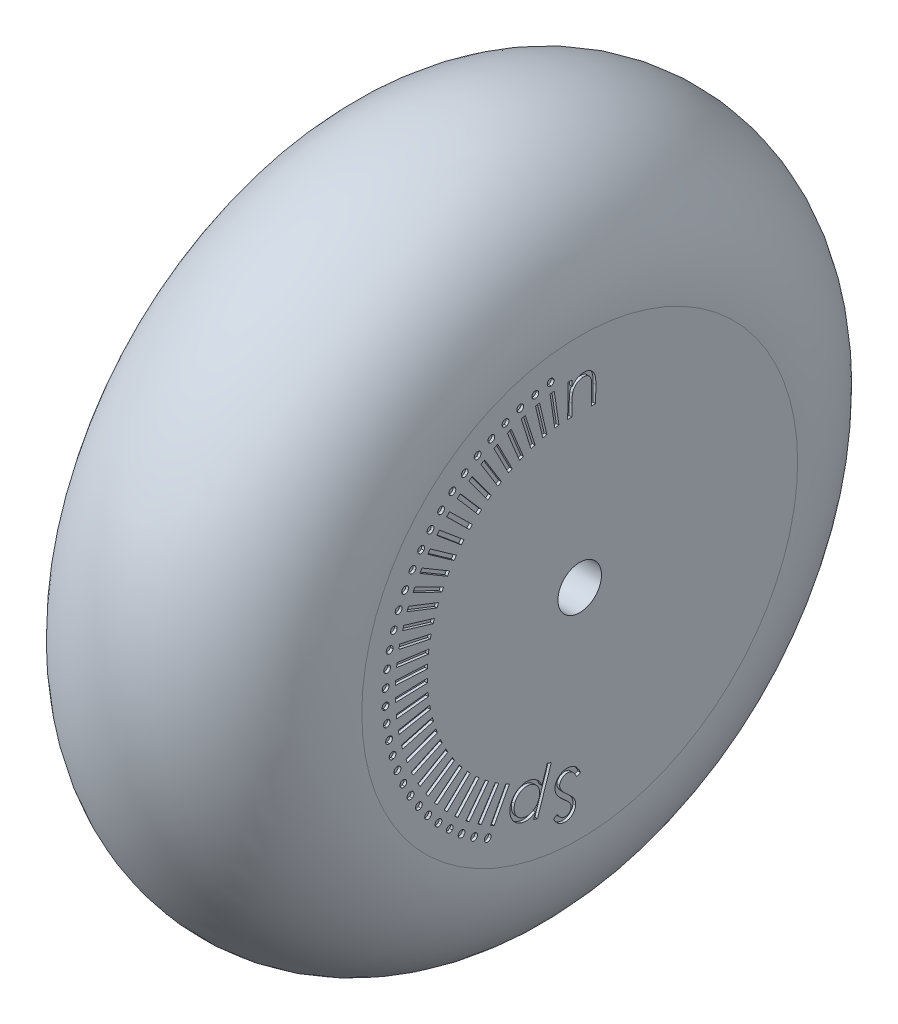
from build123d import *

# Parameters (mm, degrees)
CUT_EXTRUDE1_DEPTH = 0.79375


with BuildPart() as part:
    # Sketch1 → Revolve1 (revolve)
    with BuildSketch(Plane.XY, mode=Mode.PRIVATE) as revolve1_sk:
        with BuildLine():
            Line((-38.1, 6.35), (38.1, 6.35))
            Line((38.1, 6.35), (38.1, 63.5))
            ThreePointArc((38.1, 63.5), (0, 101.6), (-38.1, 63.5))
            Line((-38.1, 63.5), (-38.1, 6.35))
        make_face()
    revolve(revolve1_sk.sketch.rotate(Axis((-38.1, 0, 0), (1, 0, 0)), 90), axis=Axis((-38.1, 0, 0), (1, 0, 0)))

    # Sketch2 → Cut-Extrude1 (cut)
    # profile 1 of 67: a face of its own
    with BuildSketch(Plane(origin=(38.1, 0, 0), x_dir=(0, 0, -1), z_dir=(1, 0, 0))):
        with BuildLine():
            Line((-3.392324121, 53.511445991), (-2.191522838, 53.496181568))
            Line((-2.191522838, 53.496181568), (-2.211875403, 51.82218317))
            add(Edge.make_bspline(
                [(-2.211875403, 51.82218317), (-2.089368769, 51.973273843), (-1.851196706, 52.267017748), (-1.452871615, 52.652291216), (-1.041224041, 52.982046086), (-0.606385698, 53.24666844), (-0.152864923, 53.452452646), (0.319744491, 53.597446283), (0.81140101, 53.685358458), (1.14508384, 53.69150419), (1.314206328, 53.694619068)],
                knots=[0, 0, 0, 0, 1.124303651, 2.185822193, 3.198640477, 4.169509937, 5.122353713, 6.071972024, 7.022805912, 8, 8, 8, 8], degree=3))
            add(Edge.make_bspline(
                [(1.314206328, 53.694619068), (1.48434243, 53.68577654), (1.817644168, 53.668453763), (2.301885658, 53.562286245), (2.754794261, 53.387836477), (3.171032321, 53.146960667), (3.549272318, 52.855734515), (3.874889438, 52.511938472), (4.1446764, 52.122090851), (4.325347499, 51.761526159), (4.439033809, 51.440090872), (4.515262849, 51.166663539), (4.574493305, 50.860924152), (4.625838963, 50.524956089), (4.662761051, 50.157255751), (4.687907743, 49.758427432), (4.700589579, 49.329074512), (4.698763997, 49.032191885), (4.69782011, 48.878693587)],
                knots=[0, 0, 0, 0, 1.218061327, 2.386218765, 3.531675905, 4.679254681, 5.8171092, 6.937928225, 8.054480773, 9.200211375, 9.812771981, 10.49325581, 11.230240365, 12.040746734, 12.92572644, 13.87473232, 14.901165163, 16, 16, 16, 16], degree=3))
            Line((4.69782011, 48.878693587), (4.639306488, 44.070400318))
            Line((4.639306488, 44.070400318), (3.446137418, 44.08312067))
            Line((3.446137418, 44.08312067), (3.499562899, 48.540332209))
            add(Edge.make_bspline(
                [(3.499562899, 48.540332209), (3.500891362, 48.669233031), (3.503434675, 48.916010762), (3.499518368, 49.268784091), (3.496876202, 49.588637623), (3.48259996, 49.874360618), (3.468644136, 50.128123545), (3.448609247, 50.347903858), (3.424849464, 50.535037092), (3.400991722, 50.646936934), (3.390167867, 50.697704004)],
                knots=[0, 0, 0, 0, 1.429690524, 2.737110425, 3.912967801, 4.976846774, 5.909715187, 6.731459455, 7.424484569, 8, 8, 8, 8], degree=3))
            add(Edge.make_bspline(
                [(3.390167867, 50.697704004), (3.353198587, 50.844211949), (3.28191463, 51.126707742), (3.104856277, 51.511181067), (2.88014629, 51.840014679), (2.607341652, 52.111531936), (2.285479858, 52.324060194), (1.91700218, 52.473338299), (1.50483969, 52.570396274), (1.213875558, 52.581937697), (1.062343347, 52.587948395)],
                knots=[0, 0, 0, 0, 1.102771073, 2.12635697, 3.075602414, 4.000568345, 4.922183355, 5.875469018, 6.893558203, 8, 8, 8, 8], degree=3))
            add(Edge.make_bspline(
                [(1.062343347, 52.587948395), (0.972360456, 52.58709048), (0.79438519, 52.585393628), (0.530490662, 52.553340348), (0.273926087, 52.500996736), (0.024001374, 52.422817773), (-0.218592163, 52.324300382), (-0.455986798, 52.203763596), (-0.683576961, 52.057816397), (-0.904543074, 51.893673732), (-1.110656216, 51.711042692), (-1.303762015, 51.518607925), (-1.472195574, 51.310203479), (-1.631435846, 51.097055819), (-1.763606436, 50.867303057), (-1.882565624, 50.629255118), (-1.98211252, 50.379839623), (-2.033410085, 50.207133276), (-2.059231172, 50.120199997)],
                knots=[0, 0, 0, 0, 1.00878584, 1.995256267, 2.976621967, 3.942511628, 4.92824787, 5.911041883, 6.924481892, 7.957599608, 8.99569834, 10.011457437, 11.011458327, 11.99902901, 12.99262932, 13.979650028, 14.983038847, 16, 16, 16, 16], degree=3))
            add(Edge.make_bspline(
                [(-2.059231172, 50.120199997), (-2.074423871, 50.056756487), (-2.107642032, 49.918040074), (-2.143362416, 49.690005023), (-2.176692025, 49.42619103), (-2.204029325, 49.12662305), (-2.225653007, 48.79061984), (-2.247450124, 48.419284692), (-2.258844437, 48.012070942), (-2.26308966, 47.72877759), (-2.265300883, 47.581217626)],
                knots=[0, 0, 0, 0, 0.613317673, 1.340991811, 2.16896049, 3.114121267, 4.169299628, 5.335434196, 6.612098619, 8, 8, 8, 8], degree=3))
            Line((-2.265300883, 47.581217626), (-2.306006012, 44.154354645))
            Line((-2.306006012, 44.154354645), (-3.506807294, 44.169619068))
            Line((-3.506807294, 44.169619068), (-3.392324121, 53.511445991))
        make_face()
    # profile 2 of 67: a face of its own
    with BuildSketch(Plane(origin=(38.1, 0, 0), x_dir=(0, 0, -1), z_dir=(1, 0, 0))):
        with BuildLine():
            add(Edge.make_bspline(
                [(-8.623658865, 56.982012388), (-8.556692172, 56.987968807), (-8.426508003, 56.999548169), (-8.231852649, 56.973452556), (-8.048565048, 56.905411096), (-7.88010252, 56.800514596), (-7.730403329, 56.670340888), (-7.609795076, 56.514925251), (-7.527022574, 56.336080738), (-7.50011287, 56.207638511), (-7.486459345, 56.142469118)],
                knots=[0, 0, 0, 0, 1.026319967, 1.995180093, 2.9762135, 3.995373295, 5.015771186, 5.99671879, 6.983569328, 8, 8, 8, 8], degree=3))
            add(Edge.make_bspline(
                [(-7.486459345, 56.142469118), (-7.480149448, 56.077126017), (-7.467798054, 55.949219268), (-7.499554315, 55.7583014), (-7.562134915, 55.574473778), (-7.667577217, 55.406920848), (-7.798145461, 55.259092279), (-7.954355445, 55.141578731), (-8.132302732, 55.058430726), (-8.260803513, 55.031602258), (-8.326002615, 55.017989952)],
                knots=[0, 0, 0, 0, 1.007817913, 1.97276699, 2.956652193, 3.983364401, 5.001554641, 5.981873612, 6.976037138, 8, 8, 8, 8], degree=3))
            add(Edge.make_bspline(
                [(-8.326002615, 55.017989952), (-8.391272154, 55.012057287), (-8.518914392, 55.000455266), (-8.711049347, 55.026800765), (-8.89272613, 55.095000545), (-9.062457263, 55.196689515), (-9.211982562, 55.326378081), (-9.32770432, 55.482461204), (-9.413782429, 55.656269855), (-9.438094475, 55.782858409), (-9.450481781, 55.847356939)],
                knots=[0, 0, 0, 0, 1.012106001, 1.979291978, 2.971800321, 3.996090615, 5.028423881, 6.012913936, 6.987553567, 8, 8, 8, 8], degree=3))
            add(Edge.make_bspline(
                [(-9.450481781, 55.847356939), (-9.457507571, 55.914302674), (-9.471161039, 56.044400699), (-9.444452016, 56.239257674), (-9.376031314, 56.421705772), (-9.274324848, 56.591457634), (-9.144627146, 56.740921457), (-8.988595726, 56.856857924), (-8.814406307, 56.942231778), (-8.688107574, 56.968571531), (-8.623658865, 56.982012388)],
                knots=[0, 0, 0, 0, 1.033501124, 2.008439444, 2.995627413, 4.014426965, 5.041226374, 6.020439037, 6.989854079, 8, 8, 8, 8], degree=3))
        make_face()
    # profile 3 of 67: a face of its own
    with BuildSketch(Plane(origin=(38.1, 0, 0), x_dir=(0, 0, -1), z_dir=(1, 0, 0))):
        Polygon((-8.641467358, 53.079408221), (-7.440666076, 53.262581298), (-6.041427294, 44.007252772), (-7.242228576, 43.824079695), align=None)
    # profile 4 of 67: a face of its own
    with BuildSketch(Plane(origin=(38.1, 0, 0), x_dir=(0, 0, -1), z_dir=(1, 0, 0))):
        with BuildLine():
            add(Edge.make_bspline(
                [(-13.170340637, 56.058377482), (-13.105283544, 56.070657503), (-12.97735678, 56.094804651), (-12.782772098, 56.079780443), (-12.595319385, 56.027744571), (-12.419284255, 55.938184314), (-12.259871459, 55.821184245), (-12.128828984, 55.675498183), (-12.033184576, 55.504451572), (-11.996039454, 55.379153913), (-11.977171567, 55.315508893)],
                knots=[0, 0, 0, 0, 1.014462439, 1.994815498, 2.969425781, 3.990156842, 5.015294616, 5.994432325, 6.981270701, 8, 8, 8, 8], degree=3))
            add(Edge.make_bspline(
                [(-11.977171567, 55.315508893), (-11.96625673, 55.251287802), (-11.944789727, 55.124979517), (-11.95493854, 54.932096815), (-12.008218202, 54.745672177), (-12.096508946, 54.569811656), (-12.215236381, 54.412415747), (-12.359579179, 54.282392759), (-12.529053033, 54.185363757), (-12.65378012, 54.148700966), (-12.717496086, 54.129972034)],
                knots=[0, 0, 0, 0, 1.006091032, 1.978752358, 2.959526685, 3.986713487, 5.007845099, 5.993175486, 6.974827621, 8, 8, 8, 8], degree=3))
            add(Edge.make_bspline(
                [(-12.717496086, 54.129972034), (-12.781726503, 54.1176398), (-12.908827781, 54.093236368), (-13.102052804, 54.109455816), (-13.2904918, 54.157173893), (-13.465663958, 54.248084861), (-13.625991812, 54.363468216), (-13.751494461, 54.51130481), (-13.853952929, 54.67519893), (-13.888186977, 54.799514929), (-13.905577016, 54.862664341)],
                knots=[0, 0, 0, 0, 1.008807334, 1.996261373, 2.974496925, 4.002621436, 5.035184579, 6.012714205, 6.990508613, 8, 8, 8, 8], degree=3))
            add(Edge.make_bspline(
                [(-13.905577016, 54.862664341), (-13.917955634, 54.928590427), (-13.94214631, 55.057425199), (-13.926185134, 55.252316902), (-13.878304189, 55.440686966), (-13.787662779, 55.616171964), (-13.671042005, 55.775780765), (-13.525601145, 55.905915535), (-13.356925952, 56.002450504), (-13.233178852, 56.039542391), (-13.170340637, 56.058377482)],
                knots=[0, 0, 0, 0, 1.029202256, 2.011298523, 2.984226321, 4.006772389, 5.033733004, 6.01461176, 6.991828882, 8, 8, 8, 8], degree=3))
        make_face()
    # profile 5 of 67: a face of its own
    with BuildSketch(Plane(origin=(38.1, 0, 0), x_dir=(0, 0, -1), z_dir=(1, 0, 0))):
        Polygon((-12.877772529, 52.181214021), (-11.699867881, 52.455973636), (-9.570480862, 43.373641905), (-10.748385509, 43.09888229), align=None)
    # profile 6 of 67: a face of its own
    with BuildSketch(Plane(origin=(38.1, 0, 0), x_dir=(0, 0, -1), z_dir=(1, 0, 0))):
        with BuildLine():
            add(Edge.make_bspline(
                [(-17.643111082, 54.85664157), (-17.579129743, 54.873942327), (-17.452704636, 54.908128078), (-17.257075385, 54.908721653), (-17.065480224, 54.871844297), (-16.882120211, 54.797848141), (-16.712765332, 54.694079561), (-16.572531848, 54.557446687), (-16.459155774, 54.397715368), (-16.412604484, 54.275345285), (-16.38888432, 54.21299173)],
                knots=[0, 0, 0, 0, 1.013627136, 2.002895247, 2.970346224, 3.992709893, 5.021927105, 5.997660084, 6.979709672, 8, 8, 8, 8], degree=3))
            add(Edge.make_bspline(
                [(-16.38888432, 54.21299173), (-16.371516558, 54.149007401), (-16.337644395, 54.024219431), (-16.337353442, 53.829609974), (-16.372753587, 53.638165309), (-16.449989942, 53.455350003), (-16.555606937, 53.28750127), (-16.688867188, 53.144568819), (-16.851332916, 53.034656183), (-16.972903538, 52.987811049), (-17.03507823, 52.963853108)],
                knots=[0, 0, 0, 0, 1.015825537, 1.981153962, 2.963516596, 3.992984685, 5.013405796, 6.000692152, 6.97749682, 8, 8, 8, 8], degree=3))
            add(Edge.make_bspline(
                [(-17.03507823, 52.963853108), (-17.098206204, 52.946505425), (-17.222085058, 52.912463289), (-17.415991735, 52.912195255), (-17.606789713, 52.948348716), (-17.790587145, 53.021950531), (-17.958113371, 53.127260351), (-18.097982381, 53.262999363), (-18.211122674, 53.421717183), (-18.256299509, 53.543445785), (-18.279128711, 53.604958877)],
                knots=[0, 0, 0, 0, 1.007734702, 1.977522967, 2.96442414, 3.993738747, 5.018874228, 6.001241107, 6.989967542, 8, 8, 8, 8], degree=3))
            add(Edge.make_bspline(
                [(-18.279128711, 53.604958877), (-18.296130127, 53.668946389), (-18.329728697, 53.795399907), (-18.334639663, 53.990957955), (-18.296631839, 54.182604277), (-18.222923974, 54.365910162), (-18.119183221, 54.53544526), (-17.982654726, 54.674544973), (-17.826038753, 54.789356445), (-17.704738726, 54.833973465), (-17.643111082, 54.85664157)],
                knots=[0, 0, 0, 0, 1.017122034, 2.010058771, 2.980845433, 4.006734123, 5.039499986, 6.018597207, 6.993329282, 8, 8, 8, 8], degree=3))
        make_face()
    # profile 7 of 67: a face of its own
    with BuildSketch(Plane(origin=(38.1, 0, 0), x_dir=(0, 0, -1), z_dir=(1, 0, 0))):
        Polygon((-17.0376223, 51.004918813), (-15.885158358, 51.373809038), (-13.025623102, 42.464474102), (-14.178087044, 42.095583877), align=None)
    # profile 8 of 67: a face of its own
    with BuildSketch(Plane(origin=(38.1, 0, 0), x_dir=(0, 0, -1), z_dir=(1, 0, 0))):
        with BuildLine():
            add(Edge.make_bspline(
                [(-22.000642636, 53.256012103), (-21.937695255, 53.27809799), (-21.81422537, 53.321418965), (-21.618977654, 53.341576032), (-21.423806561, 53.320983119), (-21.235919685, 53.257461241), (-21.057172422, 53.170428224), (-20.908421469, 53.043288572), (-20.780130378, 52.894693314), (-20.7258321, 52.775201253), (-20.698078533, 52.714125083)],
                knots=[0, 0, 0, 0, 1.018721161, 1.99819885, 2.97767654, 4.000280446, 5.022471994, 6.000140223, 6.977808451, 8, 8, 8, 8], degree=3))
            add(Edge.make_bspline(
                [(-20.698078533, 52.714125083), (-20.677173678, 52.651984979), (-20.636114004, 52.529934266), (-20.613681629, 52.337287925), (-20.640439158, 52.144910293), (-20.697292236, 51.956843307), (-20.788274525, 51.780514074), (-20.911369037, 51.62926065), (-21.063590596, 51.504456389), (-21.181711872, 51.448166134), (-21.242509623, 51.419193192)],
                knots=[0, 0, 0, 0, 1.008602881, 1.981018568, 2.954925087, 3.9798117, 4.996589045, 5.990274095, 6.965581666, 8, 8, 8, 8], degree=3))
            add(Edge.make_bspline(
                [(-21.242509623, 51.419193192), (-21.304626939, 51.397897529), (-21.42655176, 51.356098074), (-21.620182332, 51.339178864), (-21.813540442, 51.36023615), (-22.003082539, 51.418145862), (-22.176877089, 51.511797637), (-22.328349896, 51.633104281), (-22.45097784, 51.783262969), (-22.506644063, 51.899526573), (-22.534897443, 51.958536141)],
                knots=[0, 0, 0, 0, 1.012563598, 1.987475386, 2.976750643, 4.005661918, 5.032564906, 6.011702447, 6.990839987, 8, 8, 8, 8], degree=3))
            add(Edge.make_bspline(
                [(-22.534897443, 51.958536141), (-22.556955975, 52.021472206), (-22.600223294, 52.144919895), (-22.620770913, 52.340329167), (-22.598713325, 52.534629125), (-22.541258599, 52.72434962), (-22.446409967, 52.89800605), (-22.327814662, 53.052085639), (-22.17491164, 53.171722398), (-22.059475154, 53.227556235), (-22.000642636, 53.256012103)],
                knots=[0, 0, 0, 0, 1.024718676, 2.009962843, 2.99520701, 4.019925686, 5.042644258, 6.027975014, 6.994952104, 8, 8, 8, 8], degree=3))
        make_face()
    # profile 9 of 67: a face of its own
    with BuildSketch(Plane(origin=(38.1, 0, 0), x_dir=(0, 0, -1), z_dir=(1, 0, 0))):
        Polygon((-21.087321321, 49.465347038), (-19.965386225, 49.928367872), (-16.401143437, 41.278528128), (-17.523078533, 40.815507295), align=None)
    # profile 10 of 67: a face of its own
    with BuildSketch(Plane(origin=(38.1, 0, 0), x_dir=(0, 0, -1), z_dir=(1, 0, 0))):
        with BuildLine():
            add(Edge.make_bspline(
                [(-26.197930152, 51.264053209), (-26.13689308, 51.291141741), (-26.017334001, 51.344202609), (-25.824600956, 51.380399545), (-25.629963118, 51.374168123), (-25.437422199, 51.330872655), (-25.256604473, 51.25271663), (-25.09374947, 51.145424547), (-24.961840144, 51.001091218), (-24.895937616, 50.888858263), (-24.862293132, 50.831561222)],
                knots=[0, 0, 0, 0, 1.024644926, 2.007068833, 2.985761729, 4.001650627, 5.024217585, 6.00108318, 6.979515242, 8, 8, 8, 8], degree=3))
            add(Edge.make_bspline(
                [(-24.862293132, 50.831561222), (-24.836310386, 50.772165638), (-24.78502282, 50.654924186), (-24.747377182, 50.465012173), (-24.758284339, 50.271264897), (-24.80031486, 50.078718706), (-24.8786548, 49.897725838), (-24.98679448, 49.735035433), (-25.129420998, 49.600402786), (-25.242434125, 49.534505012), (-25.299873261, 49.501012344)],
                knots=[0, 0, 0, 0, 0.999649904, 1.973217487, 2.956341683, 3.97637737, 5.003118376, 5.98397147, 6.975349693, 8, 8, 8, 8], degree=3))
            add(Edge.make_bspline(
                [(-25.299873261, 49.501012344), (-25.359215247, 49.474735425), (-25.476209513, 49.422929798), (-25.666729712, 49.389539349), (-25.86016513, 49.399250296), (-26.052567316, 49.441845679), (-26.233649366, 49.51888788), (-26.392161147, 49.629120042), (-26.529543802, 49.764635272), (-26.593039609, 49.876572377), (-26.625333998, 49.933504331)],
                knots=[0, 0, 0, 0, 1.005954779, 1.983265947, 2.97259079, 3.999059927, 5.032276675, 6.008431734, 6.987075175, 8, 8, 8, 8], degree=3))
            add(Edge.make_bspline(
                [(-26.625333998, 49.933504331), (-26.652724273, 49.994487187), (-26.706313614, 50.113800737), (-26.73825373, 50.307134023), (-26.733197121, 50.501468557), (-26.689343835, 50.693862924), (-26.612480053, 50.874773199), (-26.503116149, 51.033429143), (-26.365864864, 51.168127121), (-26.25472072, 51.231613835), (-26.197930152, 51.264053209)],
                knots=[0, 0, 0, 0, 1.031099633, 2.017356463, 3.002214593, 4.024503041, 5.053511616, 6.025690909, 6.991200701, 8, 8, 8, 8], degree=3))
        make_face()
    # profile 11 of 67: a face of its own
    with BuildSketch(Plane(origin=(38.1, 0, 0), x_dir=(0, 0, -1), z_dir=(1, 0, 0))):
        Polygon((-24.989496658, 47.572606895), (-23.913354831, 48.122126126), (-19.680021498, 39.818279972), (-20.756163325, 39.268760741), align=None)
    # profile 12 of 67: a face of its own
    with BuildSketch(Plane(origin=(38.1, 0, 0), x_dir=(0, 0, -1), z_dir=(1, 0, 0))):
        with BuildLine():
            add(Edge.make_bspline(
                [(-30.275875277, 49.02621764), (-30.21761164, 49.058377709), (-30.102999296, 49.121640853), (-29.913507583, 49.17294504), (-29.717844102, 49.182462398), (-29.521216633, 49.154041202), (-29.332273752, 49.091444241), (-29.160529139, 48.996826083), (-29.013452015, 48.866272565), (-28.939765861, 48.758330437), (-28.9020772, 48.703120685)],
                knots=[0, 0, 0, 0, 1.016023137, 1.998653008, 2.973706857, 3.996343721, 5.022682077, 6.004968852, 6.979590477, 8, 8, 8, 8], degree=3))
            add(Edge.make_bspline(
                [(-28.9020772, 48.703120685), (-28.871057776, 48.64561398), (-28.809904432, 48.532242199), (-28.756597767, 48.345204134), (-28.752032749, 48.150062823), (-28.77880081, 47.954373262), (-28.842064134, 47.76571161), (-28.939452968, 47.596111604), (-29.069488472, 47.4482279), (-29.177540436, 47.374609054), (-29.232806366, 47.336954819)],
                knots=[0, 0, 0, 0, 1.003188879, 1.977740008, 2.956644555, 3.983957634, 5.002625102, 5.995846166, 6.974924447, 8, 8, 8, 8], degree=3))
            add(Edge.make_bspline(
                [(-29.232806366, 47.336954819), (-29.290310045, 47.305855929), (-29.403675861, 47.244545921), (-29.589972193, 47.192609235), (-29.784092189, 47.183367857), (-29.978955926, 47.211550011), (-30.167210688, 47.273644728), (-30.334114927, 47.371981266), (-30.480122924, 47.499808827), (-30.553598266, 47.605672996), (-30.59134002, 47.660051774)],
                knots=[0, 0, 0, 0, 1.009819908, 1.990812773, 2.96369083, 3.997794398, 5.023195208, 6.011626241, 6.978640858, 8, 8, 8, 8], degree=3))
            add(Edge.make_bspline(
                [(-30.59134002, 47.660051774), (-30.623871891, 47.718232777), (-30.687759146, 47.832490717), (-30.733772362, 48.022968732), (-30.74882563, 48.217060726), (-30.718938828, 48.412308256), (-30.656018533, 48.599150182), (-30.562687219, 48.769429053), (-30.433546678, 48.914054307), (-30.329204606, 48.988280542), (-30.275875277, 49.02621764)],
                knots=[0, 0, 0, 0, 1.024572479, 2.01209219, 2.996134708, 4.014414973, 5.036978156, 6.027530398, 6.991868961, 8, 8, 8, 8], degree=3))
        make_face()
    # profile 13 of 67: a face of its own
    with BuildSketch(Plane(origin=(38.1, 0, 0), x_dir=(0, 0, -1), z_dir=(1, 0, 0))):
        Polygon((-28.762153321, 45.433990076), (-27.729260693, 46.070007704), (-22.814116462, 38.11215514), (-23.847009091, 37.476137512), align=None)
    # profile 14 of 67: a face of its own
    with BuildSketch(Plane(origin=(38.1, 0, 0), x_dir=(0, 0, -1), z_dir=(1, 0, 0))):
        with BuildLine():
            add(Edge.make_bspline(
                [(-34.108922425, 46.411676695), (-34.053314561, 46.44781387), (-33.943824248, 46.518966945), (-33.75941542, 46.586690603), (-33.565085338, 46.611411246), (-33.36741938, 46.598273264), (-33.175873084, 46.54958715), (-32.995648262, 46.472325786), (-32.840546418, 46.351540905), (-32.757112133, 46.2513584), (-32.714771784, 46.200518843)],
                knots=[0, 0, 0, 0, 1.0151315, 1.998765232, 2.98308694, 3.99988423, 5.019009051, 6.003072825, 6.986620526, 8, 8, 8, 8], degree=3))
            add(Edge.make_bspline(
                [(-32.714771784, 46.200518843), (-32.678096717, 46.145969736), (-32.606255461, 46.039115773), (-32.546029049, 45.854245844), (-32.519666091, 45.661870209), (-32.533694471, 45.464220148), (-32.580611764, 45.272405059), (-32.663174405, 45.095117361), (-32.782382569, 44.938840071), (-32.884195825, 44.856156913), (-32.936105919, 44.814000413)],
                knots=[0, 0, 0, 0, 1.0076066, 1.973758426, 2.961632084, 3.982098512, 5.00490087, 5.986108696, 6.973205553, 8, 8, 8, 8], degree=3))
            add(Edge.make_bspline(
                [(-32.936105919, 44.814000413), (-32.990894089, 44.778717143), (-33.098131852, 44.709656634), (-33.279071261, 44.644274772), (-33.470653744, 44.619077269), (-33.667165345, 44.63307841), (-33.858830091, 44.678927354), (-34.032569358, 44.763858815), (-34.190876604, 44.875214364), (-34.271423324, 44.976244703), (-34.312448066, 45.027702336)],
                knots=[0, 0, 0, 0, 1.010183946, 1.977249227, 2.96122408, 3.991154012, 5.023441536, 6.001841918, 6.982281097, 8, 8, 8, 8], degree=3))
            add(Edge.make_bspline(
                [(-34.312448066, 45.027702336), (-34.348572668, 45.083309638), (-34.419700987, 45.192798843), (-34.487312442, 45.376418698), (-34.51151729, 45.5697659), (-34.502093606, 45.766581854), (-34.454149783, 45.958475401), (-34.37188655, 46.13367179), (-34.257961563, 46.289398987), (-34.15923473, 46.370398455), (-34.108922425, 46.411676695)],
                knots=[0, 0, 0, 0, 1.023378201, 2.015002752, 2.994322602, 4.018624771, 5.046028734, 6.031651029, 6.996907212, 8, 8, 8, 8], degree=3))
        make_face()
    # profile 15 of 67: a face of its own
    with BuildSketch(Plane(origin=(38.1, 0, 0), x_dir=(0, 0, -1), z_dir=(1, 0, 0))):
        Polygon((-32.315352714, 42.959373009), (-31.340973707, 43.674256823), (-25.812708483, 36.148896246), (-26.787087489, 35.434012432), align=None)
    # profile 16 of 67: a face of its own
    with BuildSketch(Plane(origin=(38.1, 0, 0), x_dir=(0, 0, -1), z_dir=(1, 0, 0))):
        with BuildLine():
            add(Edge.make_bspline(
                [(-37.767582627, 43.573837823), (-37.714847176, 43.615242979), (-37.611498867, 43.696386742), (-37.43108603, 43.77616464), (-37.238830112, 43.816950708), (-37.039825598, 43.820929629), (-36.842054286, 43.792927087), (-36.659343532, 43.722204737), (-36.492180211, 43.618482129), (-36.40203754, 43.52351646), (-36.355623492, 43.474619073)],
                knots=[0, 0, 0, 0, 1.02042698, 1.999781959, 2.979992346, 4.003126142, 5.024866413, 6.00832056, 6.974493384, 8, 8, 8, 8], degree=3))
            add(Edge.make_bspline(
                [(-36.355623492, 43.474619073), (-36.315252611, 43.422620841), (-36.235912533, 43.320429765), (-36.155439752, 43.142623227), (-36.114515226, 42.950971931), (-36.113618406, 42.751650236), (-36.144764984, 42.55444724), (-36.214722777, 42.371431599), (-36.31865556, 42.204314513), (-36.413592077, 42.114165429), (-36.462474454, 42.067748079)],
                knots=[0, 0, 0, 0, 1.005889792, 1.976854892, 2.960515143, 3.987003231, 5.014395387, 6.001310815, 6.970884099, 8, 8, 8, 8], degree=3))
            add(Edge.make_bspline(
                [(-36.462474454, 42.067748079), (-36.514352247, 42.027127111), (-36.616032405, 41.947510261), (-36.794410231, 41.870994643), (-36.984266735, 41.829693511), (-37.182180415, 41.824519793), (-37.377724682, 41.85826605), (-37.561125941, 41.923584656), (-37.726622259, 42.027780303), (-37.816063076, 42.121617068), (-37.861713236, 42.1695109)],
                knots=[0, 0, 0, 0, 1.012661109, 1.98480958, 2.962310896, 3.995957266, 5.017365776, 6.006351126, 6.982451258, 8, 8, 8, 8], degree=3))
            add(Edge.make_bspline(
                [(-37.861713236, 42.1695109), (-37.903124746, 42.22224264), (-37.984280961, 42.325583677), (-38.063630034, 42.505283276), (-38.104836297, 42.696448933), (-38.109778973, 42.895073686), (-38.077134982, 43.090939071), (-38.01034701, 43.273917673), (-37.906841925, 43.437968043), (-37.814505084, 43.52805744), (-37.767582627, 43.573837823)],
                knots=[0, 0, 0, 0, 1.027429736, 2.013505613, 2.987705324, 4.017860453, 5.048675197, 6.02208965, 6.994892909, 8, 8, 8, 8], degree=3))
        make_face()
    # profile 17 of 67: a face of its own
    with BuildSketch(Plane(origin=(38.1, 0, 0), x_dir=(0, 0, -1), z_dir=(1, 0, 0))):
        Polygon((-35.691621088, 40.258913945), (-34.773211633, 41.052663945), (-28.629281345, 33.959795355), (-29.5476908, 33.166045355), align=None)
    # profile 18 of 67: a face of its own
    with BuildSketch(Plane(origin=(38.1, 0, 0), x_dir=(0, 0, -1), z_dir=(1, 0, 0))):
        with BuildLine():
            add(Edge.make_bspline(
                [(-41.109437454, 40.342211491), (-41.06034097, 40.387845871), (-40.96437172, 40.477047723), (-40.790996341, 40.569165827), (-40.604596829, 40.627140388), (-40.406299846, 40.642875437), (-40.209232731, 40.625821796), (-40.0194141, 40.575292703), (-39.84717555, 40.482321815), (-39.749372206, 40.395962923), (-39.700022389, 40.352387773)],
                knots=[0, 0, 0, 0, 1.024199227, 2.002009633, 2.981203081, 3.999771157, 5.031294121, 6.003204641, 6.992452821, 8, 8, 8, 8], degree=3))
            add(Edge.make_bspline(
                [(-39.700022389, 40.352387773), (-39.655161442, 40.304155188), (-39.567477227, 40.209880845), (-39.478730572, 40.038460915), (-39.419436978, 39.854461607), (-39.405725465, 39.657928243), (-39.417256614, 39.460818753), (-39.473598985, 39.273762819), (-39.562257809, 39.09846763), (-39.650086658, 39.000585808), (-39.694934248, 38.950604921)],
                knots=[0, 0, 0, 0, 1.011767456, 1.977578253, 2.95001183, 3.974555059, 4.998011859, 5.979206276, 6.968132567, 8, 8, 8, 8], degree=3))
            add(Edge.make_bspline(
                [(-39.694934248, 38.950604921), (-39.743458291, 38.907100116), (-39.838993751, 38.82144667), (-40.007532666, 38.727617723), (-40.193619862, 38.674813294), (-40.389372362, 38.653821471), (-40.585776963, 38.672699256), (-40.773093289, 38.721758673), (-40.942629997, 38.814371582), (-41.039619962, 38.89785305), (-41.089084889, 38.940428639)],
                knots=[0, 0, 0, 0, 1.010549305, 1.989597049, 2.965180699, 3.998327242, 5.030212671, 6.014830516, 6.987562618, 8, 8, 8, 8], degree=3))
            add(Edge.make_bspline(
                [(-41.089084889, 38.940428639), (-41.133335017, 38.989859979), (-41.219960254, 39.086628097), (-41.317515613, 39.255925388), (-41.372992085, 39.443091787), (-41.39254261, 39.639847154), (-41.377697177, 39.83723669), (-41.328444436, 40.02552179), (-41.235509828, 40.195749597), (-41.152018216, 40.292744198), (-41.109437454, 40.342211491)],
                knots=[0, 0, 0, 0, 1.022329081, 2.001338857, 2.986802754, 4.013146232, 5.037149892, 6.027902464, 6.994229318, 8, 8, 8, 8], degree=3))
        make_face()
    # profile 19 of 67: a face of its own
    with BuildSketch(Plane(origin=(38.1, 0, 0), x_dir=(0, 0, -1), z_dir=(1, 0, 0))):
        Polygon((-38.786701075, 37.218092902), (-37.939525595, 38.080532805), (-31.279148992, 31.537183447), (-32.126324473, 30.674743543), align=None)
    # profile 20 of 67: a face of its own
    with BuildSketch(Plane(origin=(38.1, 0, 0), x_dir=(0, 0, -1), z_dir=(1, 0, 0))):
        with BuildLine():
            add(Edge.make_bspline(
                [(-44.237186104, 36.924783999), (-44.192381559, 36.97347063), (-44.103962065, 37.069551223), (-43.940114638, 37.177188953), (-43.758410368, 37.250092772), (-43.562890253, 37.283865739), (-43.364270987, 37.285688029), (-43.172751986, 37.246002964), (-42.990638706, 37.172183469), (-42.886402904, 37.092776963), (-42.832859181, 37.051987524)],
                knots=[0, 0, 0, 0, 1.010872254, 1.994905021, 2.974723496, 3.991842188, 5.018547196, 5.999829822, 6.972554965, 8, 8, 8, 8], degree=3))
            add(Edge.make_bspline(
                [(-42.832859181, 37.051987524), (-42.785142052, 37.007080254), (-42.691408731, 36.918866491), (-42.584534569, 36.75692064), (-42.515923623, 36.575130358), (-42.481225404, 36.380322874), (-42.479512587, 36.182433265), (-42.519547164, 35.990626001), (-42.595058769, 35.810246848), (-42.673621403, 35.705590159), (-42.713287867, 35.652748742)],
                knots=[0, 0, 0, 0, 1.00747811, 1.979043384, 2.95971017, 3.982670728, 5.015272661, 5.989384407, 6.984835297, 8, 8, 8, 8], degree=3))
            add(Edge.make_bspline(
                [(-42.713287867, 35.652748742), (-42.758166998, 35.604963215), (-42.846325487, 35.511095535), (-43.008937984, 35.405033574), (-43.189498175, 35.332594525), (-43.384261363, 35.298577277), (-43.581560222, 35.298083843), (-43.772359522, 35.332718552), (-43.951517437, 35.408485247), (-44.054616872, 35.48588862), (-44.107438508, 35.525545217)],
                knots=[0, 0, 0, 0, 1.010911861, 1.985788486, 2.974593252, 4.00104033, 5.024046183, 6.01180662, 6.981375348, 8, 8, 8, 8], degree=3))
            add(Edge.make_bspline(
                [(-44.107438508, 35.525545217), (-44.157252623, 35.570999727), (-44.254346318, 35.659596028), (-44.359424388, 35.825981639), (-44.432930777, 36.006761258), (-44.466401444, 36.202398355), (-44.468616222, 36.400221659), (-44.428132889, 36.590684549), (-44.355868369, 36.770528498), (-44.277092637, 36.872916079), (-44.237186104, 36.924783999)],
                knots=[0, 0, 0, 0, 1.033160126, 2.013753233, 2.997292371, 4.018273367, 5.048877081, 6.021103794, 6.997522664, 8, 8, 8, 8], degree=3))
        make_face()
    # profile 21 of 67: a face of its own
    with BuildSketch(Plane(origin=(38.1, 0, 0), x_dir=(0, 0, -1), z_dir=(1, 0, 0))):
        Polygon((-41.667674886, 33.991470697), (-40.88918931, 34.922600505), (-33.709822322, 28.921138165), (-34.488307899, 27.990008358), align=None)
    # profile 22 of 67: a face of its own
    with BuildSketch(Plane(origin=(38.1, 0, 0), x_dir=(0, 0, -1), z_dir=(1, 0, 0))):
        with BuildLine():
            add(Edge.make_bspline(
                [(-47.032123471, 33.216694098), (-46.990690116, 33.268411789), (-46.909180883, 33.370152747), (-46.7560464, 33.492829071), (-46.57965762, 33.576582507), (-46.389008723, 33.627122713), (-46.192189739, 33.643007278), (-45.998429874, 33.620054499), (-45.812393838, 33.55829724), (-45.702027454, 33.488814298), (-45.645605042, 33.453292655)],
                knots=[0, 0, 0, 0, 1.016567065, 1.999828397, 2.985074984, 3.996867244, 5.016605092, 6.001247895, 6.978181478, 8, 8, 8, 8], degree=3))
            add(Edge.make_bspline(
                [(-45.645605042, 33.453292655), (-45.594744469, 33.412707735), (-45.494716801, 33.33288923), (-45.374396515, 33.182253341), (-45.292937562, 33.006518311), (-45.242743687, 32.816007561), (-45.228053423, 32.618735391), (-45.245700584, 32.423937728), (-45.312549631, 32.239201055), (-45.381476258, 32.128391228), (-45.416638696, 32.071862367)],
                knots=[0, 0, 0, 0, 1.003036225, 1.972674871, 2.945228668, 3.974602872, 4.999299598, 5.9872556, 6.973212481, 8, 8, 8, 8], degree=3))
            add(Edge.make_bspline(
                [(-45.416638696, 32.071862367), (-45.45703554, 32.020735317), (-45.536158554, 31.920595657), (-45.689235048, 31.80406541), (-45.862574285, 31.718236424), (-46.053977259, 31.669736902), (-46.249870895, 31.652624792), (-46.441218395, 31.677616364), (-46.62497125, 31.733856104), (-46.733220557, 31.802924404), (-46.787892702, 31.83780788)],
                knots=[0, 0, 0, 0, 1.011192299, 1.980565177, 2.966790223, 4.004534666, 5.037563595, 6.008823375, 6.994340943, 8, 8, 8, 8], degree=3))
            add(Edge.make_bspline(
                [(-46.787892702, 31.83780788), (-46.839623773, 31.879232218), (-46.941391053, 31.960723712), (-47.063394289, 32.113386727), (-47.148229048, 32.289396999), (-47.201129293, 32.47974747), (-47.21697494, 32.677022953), (-47.192688307, 32.869195765), (-47.136043366, 33.053775469), (-47.066996249, 33.1620229), (-47.032123471, 33.216694098)],
                knots=[0, 0, 0, 0, 1.021913016, 2.010345151, 2.989000959, 4.022193249, 5.047293722, 6.024105576, 7.002059336, 8, 8, 8, 8], degree=3))
        make_face()
    # profile 23 of 67: a face of its own
    with BuildSketch(Plane(origin=(38.1, 0, 0), x_dir=(0, 0, -1), z_dir=(1, 0, 0))):
        Polygon((-44.243822189, 30.507259002), (-43.546746869, 31.494358361), (-35.934887895, 26.106017014), (-36.631963215, 25.118917655), align=None)
    # profile 24 of 67: a face of its own
    with BuildSketch(Plane(origin=(38.1, 0, 0), x_dir=(0, 0, -1), z_dir=(1, 0, 0))):
        with BuildLine():
            add(Edge.make_bspline(
                [(-49.584340412, 29.327273075), (-49.547439743, 29.382429881), (-49.475057425, 29.490622432), (-49.330963921, 29.622035064), (-49.165070547, 29.724642316), (-48.976954062, 29.787441201), (-48.781806346, 29.822842452), (-48.58618161, 29.814114742), (-48.395948729, 29.768744162), (-48.279911877, 29.708888603), (-48.220718617, 29.678354806)],
                knots=[0, 0, 0, 0, 1.016351871, 1.993619837, 2.970105816, 3.992037732, 5.022324243, 6.000286786, 6.979896972, 8, 8, 8, 8], degree=3))
            add(Edge.make_bspline(
                [(-48.220718617, 29.678354806), (-48.166523592, 29.642232571), (-48.059267348, 29.570743808), (-47.927193163, 29.427899982), (-47.829980925, 29.258655806), (-47.764492109, 29.072188831), (-47.734770746, 28.877348279), (-47.737022913, 28.682300936), (-47.787940147, 28.492909996), (-47.847125458, 28.376543594), (-47.877269098, 28.317277081)],
                knots=[0, 0, 0, 0, 1.00138745, 1.981825039, 2.96600228, 3.99124868, 5.009891034, 5.990589992, 6.97658842, 8, 8, 8, 8], degree=3))
            add(Edge.make_bspline(
                [(-47.877269098, 28.317277081), (-47.914348371, 28.26314215), (-47.987452972, 28.156411025), (-48.129815396, 28.024530994), (-48.297426011, 27.925834535), (-48.483486198, 27.861241356), (-48.677468181, 27.831173778), (-48.87039648, 27.834385497), (-49.058110096, 27.8812498), (-49.17238262, 27.940856452), (-49.230714611, 27.971283492)],
                knots=[0, 0, 0, 0, 1.014744014, 2.000644844, 2.97898133, 4.009940657, 5.034259138, 6.007283351, 6.982790225, 8, 8, 8, 8], degree=3))
            add(Edge.make_bspline(
                [(-49.230714611, 27.971283492), (-49.285853489, 28.008190698), (-49.394010876, 28.080585841), (-49.525679405, 28.224586018), (-49.627458092, 28.3910817), (-49.69382371, 28.577317094), (-49.728727818, 28.772151984), (-49.720327588, 28.966086302), (-49.674668131, 29.154670985), (-49.614866819, 29.268941904), (-49.584340412, 29.327273075)],
                knots=[0, 0, 0, 0, 1.020549186, 2.001853061, 2.982371717, 4.012934709, 5.034573464, 6.016574783, 6.987533165, 8, 8, 8, 8], degree=3))
        make_face()
    # profile 25 of 67: a face of its own
    with BuildSketch(Plane(origin=(38.1, 0, 0), x_dir=(0, 0, -1), z_dir=(1, 0, 0))):
        Polygon((-46.579793136, 26.849348396), (-45.964128072, 27.892417306), (-37.919777111, 23.135005447), (-38.535442175, 22.091936537), align=None)
    # profile 26 of 67: a face of its own
    with BuildSketch(Plane(origin=(38.1, 0, 0), x_dir=(0, 0, -1), z_dir=(1, 0, 0))):
        with BuildLine():
            add(Edge.make_bspline(
                [(-51.771134318, 25.234066428), (-51.738553522, 25.292373978), (-51.674555955, 25.406905903), (-51.541686384, 25.551614978), (-51.383315618, 25.66602323), (-51.201919839, 25.745959466), (-51.009962001, 25.794960585), (-50.813346296, 25.80295658), (-50.619626058, 25.770208152), (-50.499107829, 25.718300615), (-50.438041369, 25.69199912)],
                knots=[0, 0, 0, 0, 1.02002705, 2.003611224, 2.980313492, 3.991623976, 5.021522486, 5.996237214, 6.984695514, 8, 8, 8, 8], degree=3))
            add(Edge.make_bspline(
                [(-50.438041369, 25.69199912), (-50.381620157, 25.660067925), (-50.270249844, 25.597038666), (-50.126790025, 25.468332418), (-50.019619814, 25.307466157), (-49.939090657, 25.128851333), (-49.8894261, 24.937586959), (-49.882783528, 24.74212874), (-49.911241335, 24.54784702), (-49.963683984, 24.427555153), (-49.990284959, 24.366538383)],
                knots=[0, 0, 0, 0, 1.000727683, 1.975344925, 2.946427732, 3.967563178, 4.994741891, 5.97892605, 6.974831751, 8, 8, 8, 8], degree=3))
            add(Edge.make_bspline(
                [(-49.990284959, 24.366538383), (-50.02217405, 24.310054398), (-50.085120199, 24.198560178), (-50.214765545, 24.055647358), (-50.374444603, 23.944394522), (-50.555514163, 23.865841557), (-50.746351129, 23.815314054), (-50.939152385, 23.809287912), (-51.129930968, 23.83477513), (-51.247917726, 23.885347966), (-51.308113485, 23.911149761)],
                knots=[0, 0, 0, 0, 1.005563668, 1.984890716, 2.968197887, 4.006293756, 5.038436277, 6.014211811, 6.986869131, 8, 8, 8, 8], degree=3))
            add(Edge.make_bspline(
                [(-51.308113485, 23.911149761), (-51.366379982, 23.943756745), (-51.48083127, 24.007805751), (-51.626642094, 24.140770461), (-51.739048327, 24.3012775), (-51.820679232, 24.481678742), (-51.864847766, 24.672786398), (-51.877577056, 24.86523259), (-51.846370159, 25.055648004), (-51.796534029, 25.173832152), (-51.771134318, 25.234066428)],
                knots=[0, 0, 0, 0, 1.027993151, 2.019258817, 3.014232419, 4.033440931, 5.055586044, 6.025454654, 6.993644143, 8, 8, 8, 8], degree=3))
        make_face()
    # profile 27 of 67: a face of its own
    with BuildSketch(Plane(origin=(38.1, 0, 0), x_dir=(0, 0, -1), z_dir=(1, 0, 0))):
        Polygon((-48.580869895, 23.0105488), (-48.049159158, 24.099410979), (-39.658814606, 20.006001524), (-40.190525344, 18.917139344), align=None)
    # profile 28 of 67: a face of its own
    with BuildSketch(Plane(origin=(38.1, 0, 0), x_dir=(0, 0, -1), z_dir=(1, 0, 0))):
        with BuildLine():
            add(Edge.make_bspline(
                [(-53.691471767, 21.021600646), (-53.664582094, 21.083455342), (-53.612068451, 21.204253226), (-53.486557095, 21.35581279), (-53.339681025, 21.484909451), (-53.16417896, 21.578649579), (-52.975999223, 21.643626111), (-52.780375004, 21.665986861), (-52.58384506, 21.653051434), (-52.459491376, 21.610479525), (-52.396539876, 21.58892837)],
                knots=[0, 0, 0, 0, 1.025496367, 2.002722481, 2.976507647, 3.997000162, 5.021186408, 5.999785513, 6.987432478, 8, 8, 8, 8], degree=3))
            add(Edge.make_bspline(
                [(-52.396539876, 21.58892837), (-52.33659074, 21.56171026), (-52.219282172, 21.508449817), (-52.068839984, 21.386760016), (-51.943809897, 21.238644004), (-51.849225744, 21.064360633), (-51.785717959, 20.875744101), (-51.758784991, 20.681427223), (-51.773528939, 20.484791441), (-51.815388444, 20.360333786), (-51.836844363, 20.29654055)],
                knots=[0, 0, 0, 0, 1.008451029, 1.973338655, 2.944631734, 3.971364331, 5.001813245, 5.988034147, 6.968727056, 8, 8, 8, 8], degree=3))
            add(Edge.make_bspline(
                [(-51.836844363, 20.29654055), (-51.864051873, 20.236578009), (-51.917291574, 20.119243209), (-52.039892101, 19.968054473), (-52.188578655, 19.84175127), (-52.363997502, 19.746933662), (-52.551544838, 19.682585284), (-52.745409532, 19.659549764), (-52.93903125, 19.673340962), (-53.061986614, 19.713831732), (-53.124144042, 19.734300966)],
                knots=[0, 0, 0, 0, 1.011594792, 1.979490376, 2.972235778, 4.00216913, 5.035830384, 6.010502243, 6.99425238, 8, 8, 8, 8], degree=3))
            add(Edge.make_bspline(
                [(-53.124144042, 19.734300966), (-53.18507813, 19.761327933), (-53.304742678, 19.81440446), (-53.455840208, 19.93916053), (-53.584894519, 20.086106443), (-53.678677914, 20.261592882), (-53.743525905, 20.449762143), (-53.766141843, 20.643751772), (-53.752197692, 20.837291115), (-53.711951511, 20.95944248), (-53.691471767, 21.021600646)],
                knots=[0, 0, 0, 0, 1.020714899, 2.004516535, 2.98485407, 4.012213237, 5.043290989, 6.028474856, 6.996766116, 8, 8, 8, 8], degree=3))
        make_face()
    # profile 29 of 67: a face of its own
    with BuildSketch(Plane(origin=(38.1, 0, 0), x_dir=(0, 0, -1), z_dir=(1, 0, 0))):
        Polygon((-50.315490196, 19.049945998), (-49.872821927, 20.182057377), (-41.136483786, 16.757738466), (-41.579152055, 15.625627088), align=None)
    # profile 30 of 67: a face of its own
    with BuildSketch(Plane(origin=(38.1, 0, 0), x_dir=(0, 0, -1), z_dir=(1, 0, 0))):
        with BuildLine():
            add(Edge.make_bspline(
                [(-55.10993285, 16.590693885), (-55.087934185, 16.652971473), (-55.044476555, 16.775998774), (-54.93490104, 16.93740137), (-54.796016583, 17.073402533), (-54.631348255, 17.180652971), (-54.45045463, 17.260971676), (-54.258821978, 17.298570158), (-54.063398353, 17.301138059), (-53.937541768, 17.268669826), (-53.873514581, 17.252152219)],
                knots=[0, 0, 0, 0, 1.014512911, 2.004136466, 2.974586209, 3.993216171, 5.017782305, 6.004640095, 6.984897916, 8, 8, 8, 8], degree=3))
            add(Edge.make_bspline(
                [(-53.873514581, 17.252152219), (-53.812342263, 17.229745754), (-53.692319265, 17.185783205), (-53.529158045, 17.082091988), (-53.396927655, 16.940512479), (-53.28845152, 16.77632566), (-53.208374416, 16.595162957), (-53.170713576, 16.403599756), (-53.168161891, 16.208158069), (-53.200627909, 16.082303952), (-53.217144389, 16.01827802)],
                knots=[0, 0, 0, 0, 1.005922571, 1.973667939, 2.956932079, 3.979140459, 5.007305863, 5.997630454, 6.981331893, 8, 8, 8, 8], degree=3))
            add(Edge.make_bspline(
                [(-53.217144389, 16.01827802), (-53.239398511, 15.957013517), (-53.282818916, 15.83747928), (-53.388079946, 15.67614258), (-53.528782853, 15.544463559), (-53.692310698, 15.434804482), (-53.873641063, 15.36074183), (-54.061768612, 15.316349783), (-54.255038741, 15.316314329), (-54.380194785, 15.346610977), (-54.443386376, 15.361907828)],
                knots=[0, 0, 0, 0, 1.0128264, 1.976143195, 2.966155655, 3.995379636, 5.025450505, 5.999479652, 6.989932411, 8, 8, 8, 8], degree=3))
            add(Edge.make_bspline(
                [(-54.443386376, 15.361907828), (-54.505700654, 15.383865857), (-54.628800434, 15.427243212), (-54.790170514, 15.53774633), (-54.928487341, 15.674963715), (-55.036698523, 15.839936502), (-55.111633147, 16.021608254), (-55.155089481, 16.210020432), (-55.15545547, 16.403159355), (-55.125273212, 16.527497884), (-55.10993285, 16.590693885)],
                knots=[0, 0, 0, 0, 1.018906056, 2.012814978, 2.996704839, 4.019745775, 5.043628512, 6.024624444, 6.996000374, 8, 8, 8, 8], degree=3))
        make_face()
    # profile 31 of 67: a face of its own
    with BuildSketch(Plane(origin=(38.1, 0, 0), x_dir=(0, 0, -1), z_dir=(1, 0, 0))):
        Polygon((-51.614379966, 14.911607347), (-51.265842306, 16.064071289), (-42.35650737, 13.372444687), (-42.70504503, 12.219980744), align=None)
    # profile 32 of 67: a face of its own
    with BuildSketch(Plane(origin=(38.1, 0, 0), x_dir=(0, 0, -1), z_dir=(1, 0, 0))):
        with BuildLine():
            add(Edge.make_bspline(
                [(-56.363431471, 12.139045813), (-56.346875499, 12.203792898), (-56.314351044, 12.330989519), (-56.214844675, 12.501059784), (-56.089949357, 12.652192179), (-55.931146603, 12.772600928), (-55.75447892, 12.863281224), (-55.567044469, 12.922636816), (-55.370342391, 12.934466987), (-55.241285837, 12.914839015), (-55.175350541, 12.904811037)],
                knots=[0, 0, 0, 0, 1.016998875, 1.997909574, 2.982241072, 3.998744051, 5.019207446, 6.007628273, 6.982092611, 8, 8, 8, 8], degree=3))
            add(Edge.make_bspline(
                [(-55.175350541, 12.904811037), (-55.111447205, 12.888242762), (-54.985866157, 12.855683252), (-54.818192414, 12.75624264), (-54.669781831, 12.630449568), (-54.549278601, 12.472641154), (-54.459363587, 12.296494593), (-54.398769974, 12.109429522), (-54.387632983, 11.912531486), (-54.407256501, 11.782655846), (-54.417217528, 11.716730108)],
                knots=[0, 0, 0, 0, 1.008774365, 1.982415161, 2.960917247, 3.981632162, 5.006323904, 5.986383426, 6.977874856, 8, 8, 8, 8], degree=3))
            add(Edge.make_bspline(
                [(-54.417217528, 11.716730108), (-54.433785346, 11.652824903), (-54.466343956, 11.527240181), (-54.565791147, 11.359593299), (-54.691558927, 11.211079447), (-54.849466075, 11.090979355), (-55.025028555, 10.999675629), (-55.211580732, 10.944937251), (-55.405047853, 10.927844464), (-55.532541273, 10.94819952), (-55.597666246, 10.958597095)],
                knots=[0, 0, 0, 0, 1.014056156, 1.992794788, 2.976420163, 4.002479388, 5.032536262, 6.013983061, 6.98552176, 8, 8, 8, 8], degree=3))
            add(Edge.make_bspline(
                [(-55.597666246, 10.958597095), (-55.662414878, 10.975152702), (-55.789614537, 11.007676442), (-55.959662612, 11.107188037), (-56.110879889, 11.232063363), (-56.230960617, 11.390943374), (-56.322375466, 11.566383268), (-56.377085505, 11.752966708), (-56.394185623, 11.946425741), (-56.373829561, 12.073920272), (-56.363431471, 12.139045813)],
                knots=[0, 0, 0, 0, 1.02223353, 2.008193133, 2.997591142, 4.019326224, 5.045042107, 6.022352775, 6.989797097, 8, 8, 8, 8], degree=3))
        make_face()
    # profile 33 of 67: a face of its own
    with BuildSketch(Plane(origin=(38.1, 0, 0), x_dir=(0, 0, -1), z_dir=(1, 0, 0))):
        Polygon((-52.715234355, 10.732174819), (-52.458283234, 11.920255749), (-43.289453105, 9.938424819), (-43.546404227, 8.75034389), align=None)
    # profile 34 of 67: a face of its own
    with BuildSketch(Plane(origin=(38.1, 0, 0), x_dir=(0, 0, -1), z_dir=(1, 0, 0))):
        with BuildLine():
            add(Edge.make_bspline(
                [(-57.098687457, 7.549110225), (-57.086194332, 7.615227726), (-57.061894238, 7.743831381), (-56.978875931, 7.921469773), (-56.865596627, 8.079205543), (-56.719946263, 8.213558381), (-56.55249076, 8.318880236), (-56.369705803, 8.39021788), (-56.176037292, 8.422138068), (-56.045471212, 8.411734716), (-55.979296431, 8.406461988)],
                knots=[0, 0, 0, 0, 1.028681387, 2.00086491, 2.979294902, 3.99180952, 5.020490907, 5.996496467, 6.984564701, 8, 8, 8, 8], degree=3))
            add(Edge.make_bspline(
                [(-55.979296431, 8.406461988), (-55.914839621, 8.39492554), (-55.788506218, 8.37231445), (-55.614528146, 8.288968089), (-55.458149767, 8.175172928), (-55.326672275, 8.028151209), (-55.218422345, 7.861901406), (-55.148503312, 7.679078487), (-55.119558053, 7.484493098), (-55.129537617, 7.354077326), (-55.134665021, 7.287070962)],
                knots=[0, 0, 0, 0, 1.005655655, 1.971054758, 2.944040957, 3.971481688, 4.994502221, 5.98783907, 6.966171147, 8, 8, 8, 8], degree=3))
            add(Edge.make_bspline(
                [(-55.134665021, 7.287070962), (-55.146201189, 7.222613178), (-55.16881173, 7.096277864), (-55.252162091, 6.922313716), (-55.365941783, 6.765881491), (-55.513024484, 6.634616273), (-55.677460622, 6.526618384), (-55.858360602, 6.459870364), (-56.047846634, 6.426407601), (-56.175968813, 6.437023439), (-56.241335694, 6.442439552)],
                knots=[0, 0, 0, 0, 1.014036996, 1.987481934, 2.968577201, 4.004580835, 5.036127432, 6.008410688, 6.983907521, 8, 8, 8, 8], degree=3))
            add(Edge.make_bspline(
                [(-56.241335694, 6.442439552), (-56.307533582, 6.453831273), (-56.436469426, 6.476019309), (-56.613914568, 6.560654342), (-56.773977598, 6.671923591), (-56.907118305, 6.818565433), (-57.015133066, 6.983323454), (-57.080793924, 7.16545749), (-57.114803836, 7.355591937), (-57.104132092, 7.483733469), (-57.098687457, 7.549110225)],
                knots=[0, 0, 0, 0, 1.031807233, 2.009685507, 3.004488603, 4.02293422, 5.046578161, 6.023668212, 6.991691785, 8, 8, 8, 8], degree=3))
        make_face()
    # profile 35 of 67: a face of its own
    with BuildSketch(Plane(origin=(38.1, 0, 0), x_dir=(0, 0, -1), z_dir=(1, 0, 0))):
        Polygon((-53.366536014, 6.444983622), (-53.206259572, 7.645784904), (-43.950931046, 6.411910706), (-44.111207489, 5.211109424), align=None)
    # profile 36 of 67: a face of its own
    with BuildSketch(Plane(origin=(38.1, 0, 0), x_dir=(0, 0, -1), z_dir=(1, 0, 0))):
        with BuildLine():
            add(Edge.make_bspline(
                [(-57.546739189, 2.917679855), (-57.540179472, 2.984368404), (-57.527351416, 3.114783247), (-57.461065425, 3.299392352), (-57.359872041, 3.465656475), (-57.224356994, 3.609266137), (-57.066252027, 3.728041444), (-56.889885902, 3.814714331), (-56.698676233, 3.862155774), (-56.567514854, 3.861740308), (-56.501126208, 3.861530015)],
                knots=[0, 0, 0, 0, 1.024300187, 2.003101727, 2.977661702, 3.989756036, 5.01182526, 5.994678041, 6.984986197, 8, 8, 8, 8], degree=3))
            add(Edge.make_bspline(
                [(-56.501126208, 3.861530015), (-56.436231612, 3.854700566), (-56.307726157, 3.841176768), (-56.123957266, 3.777194873), (-55.961203673, 3.669986046), (-55.814309851, 3.537907178), (-55.696806922, 3.37875514), (-55.608539232, 3.204180338), (-55.561856489, 3.013401924), (-55.562193571, 2.882283791), (-55.562364189, 2.815917034)],
                knots=[0, 0, 0, 0, 1.002570024, 1.985307316, 2.959596228, 3.985359843, 5.011538797, 5.986614661, 6.980904836, 8, 8, 8, 8], degree=3))
            add(Edge.make_bspline(
                [(-55.562364189, 2.815917034), (-55.569040776, 2.750958384), (-55.58217993, 2.623123349), (-55.648075047, 2.440311117), (-55.752924056, 2.276193583), (-55.8862279, 2.129412453), (-56.044400658, 2.010939714), (-56.219734169, 1.927047444), (-56.407785538, 1.87891619), (-56.537323604, 1.87943599), (-56.602889029, 1.879699086)],
                knots=[0, 0, 0, 0, 1.006682697, 1.981095948, 2.97047345, 4.000444881, 5.030833356, 6.004187845, 6.989823789, 8, 8, 8, 8], degree=3))
            add(Edge.make_bspline(
                [(-56.602889029, 1.879699086), (-56.669568905, 1.886269216), (-56.799966789, 1.899117637), (-56.984698589, 1.9652563), (-57.151031546, 2.067336987), (-57.296803833, 2.201247054), (-57.416373609, 2.359595551), (-57.498276171, 2.535807791), (-57.547892221, 2.723290117), (-57.547128317, 2.852076622), (-57.546739189, 2.917679855)],
                knots=[0, 0, 0, 0, 1.028709496, 2.011724487, 2.990479654, 4.016533126, 5.043002055, 6.024454361, 6.993666448, 8, 8, 8, 8], degree=3))
        make_face()
    # profile 37 of 67: a face of its own
    with BuildSketch(Plane(origin=(38.1, 0, 0), x_dir=(0, 0, -1), z_dir=(1, 0, 0))):
        Polygon((-53.73063342, 2.121385784), (-53.669575727, 3.332363348), (-44.327748804, 2.859166233), (-44.388806496, 1.648188669), align=None)
    # profile 38 of 67: a face of its own
    with BuildSketch(Plane(origin=(38.1, 0, 0), x_dir=(0, 0, -1), z_dir=(1, 0, 0))):
        with BuildLine():
            add(Edge.make_bspline(
                [(-57.584308172, -1.72449528), (-57.582931362, -1.658002494), (-57.580221251, -1.527118158), (-57.526651586, -1.338318459), (-57.437931731, -1.164288123), (-57.316544171, -1.00767279), (-57.167920374, -0.876613632), (-57.000187277, -0.776931135), (-56.813872464, -0.716820267), (-56.68412876, -0.705197921), (-56.617561377, -0.699234863)],
                knots=[0, 0, 0, 0, 1.017376655, 2.002603228, 2.980580312, 4.00119928, 5.024884793, 6.004938632, 6.976397245, 8, 8, 8, 8], degree=3))
            add(Edge.make_bspline(
                [(-56.617561377, -0.699234863), (-56.55199286, -0.700895829), (-56.423147949, -0.704159697), (-56.235886608, -0.753528222), (-56.064598652, -0.8440747), (-55.908384675, -0.964326972), (-55.777043613, -1.113032552), (-55.678498123, -1.281332339), (-55.613583934, -1.466418017), (-55.604553467, -1.596753498), (-55.599933172, -1.663437588)],
                knots=[0, 0, 0, 0, 1.009182388, 1.983086104, 2.954087495, 3.979579259, 5.008152211, 5.992885175, 6.973091407, 8, 8, 8, 8], degree=3))
            add(Edge.make_bspline(
                [(-55.599933172, -1.663437588), (-55.601580077, -1.729017659), (-55.604816314, -1.857885276), (-55.654386321, -2.044981046), (-55.744404467, -2.217369699), (-55.867759338, -2.370908746), (-56.013774615, -2.504647782), (-56.181014868, -2.602599177), (-56.365143938, -2.663618942), (-56.493293949, -2.675149474), (-56.559047755, -2.681065793)],
                knots=[0, 0, 0, 0, 1.012936601, 1.990463291, 2.965076859, 4.002471668, 5.025059533, 6.013455757, 6.980703599, 8, 8, 8, 8], degree=3))
            add(Edge.make_bspline(
                [(-56.559047755, -2.681065793), (-56.625465275, -2.679411149), (-56.755982161, -2.676159614), (-56.94565735, -2.626713411), (-57.119162918, -2.536977474), (-57.275996059, -2.41597388), (-57.406043691, -2.267529292), (-57.507303158, -2.101595316), (-57.566015659, -1.917261505), (-57.578156562, -1.789320856), (-57.584308172, -1.72449528)],
                knots=[0, 0, 0, 0, 1.022539249, 2.00938905, 2.992328798, 4.018126812, 5.047006934, 6.020762172, 6.997150371, 8, 8, 8, 8], degree=3))
        make_face()
    # profile 39 of 67: a face of its own
    with BuildSketch(Plane(origin=(38.1, 0, 0), x_dir=(0, 0, -1), z_dir=(1, 0, 0))):
        Polygon((-53.719865063, -2.210412748), (-53.75548205, -0.999435184), (-44.413655127, -0.719587427), (-44.37803814, -1.930564991), align=None)
    # profile 40 of 67: a face of its own
    with BuildSketch(Plane(origin=(38.1, 0, 0), x_dir=(0, 0, -1), z_dir=(1, 0, 0))):
        with BuildLine():
            add(Edge.make_bspline(
                [(-57.209502169, -6.349385747), (-57.213225888, -6.283096485), (-57.220544738, -6.152807072), (-57.1817475, -5.96092943), (-57.110571895, -5.779382533), (-57.000165826, -5.615815138), (-56.864255339, -5.473083385), (-56.704414851, -5.361902811), (-56.524017537, -5.285163974), (-56.395237283, -5.263824912), (-56.329253772, -5.252891356)],
                knots=[0, 0, 0, 0, 1.017389004, 1.999645387, 2.982940279, 3.999409288, 5.014035804, 5.998108859, 6.974285251, 8, 8, 8, 8], degree=3))
            add(Edge.make_bspline(
                [(-56.329253772, -5.252891356), (-56.263885773, -5.249458255), (-56.136411359, -5.24276335), (-55.946602351, -5.276923374), (-55.769540281, -5.353408539), (-55.605735171, -5.461869037), (-55.463116668, -5.598222252), (-55.352104872, -5.757988102), (-55.274646051, -5.938099335), (-55.255352907, -6.067116065), (-55.245479733, -6.133139753)],
                knots=[0, 0, 0, 0, 1.010760336, 1.971088059, 2.953497205, 3.97645623, 4.997560998, 5.987917225, 6.97032637, 8, 8, 8, 8], degree=3))
            add(Edge.make_bspline(
                [(-55.245479733, -6.133139753), (-55.240604244, -6.198586037), (-55.231086038, -6.326353971), (-55.27121002, -6.514853722), (-55.342494332, -6.693500314), (-55.452158009, -6.856645056), (-55.587961547, -6.998448481), (-55.745297638, -7.11033121), (-55.922231619, -7.187319195), (-56.048698333, -7.206937639), (-56.113007778, -7.216913792)],
                knots=[0, 0, 0, 0, 1.017494193, 1.986409692, 2.97007089, 3.999584657, 5.027232287, 6.013108442, 6.989648017, 8, 8, 8, 8], degree=3))
            add(Edge.make_bspline(
                [(-56.113007778, -7.216913792), (-56.179292078, -7.221717016), (-56.30955597, -7.231156455), (-56.501473962, -7.191535365), (-56.682985179, -7.12055731), (-56.846674968, -7.010179334), (-56.98845186, -6.874437081), (-57.100543923, -6.717127321), (-57.176793819, -6.539871088), (-57.198466901, -6.413652419), (-57.209502169, -6.349385747)],
                knots=[0, 0, 0, 0, 1.023779046, 2.011961244, 3.001188216, 4.02378944, 5.044537056, 6.023793667, 6.993776388, 8, 8, 8, 8], degree=3))
        make_face()
    # profile 41 of 67: a face of its own
    with BuildSketch(Plane(origin=(38.1, 0, 0), x_dir=(0, 0, -1), z_dir=(1, 0, 0))):
        Polygon((-53.332338708, -6.524926612), (-53.464630374, -5.32412533), (-44.209301849, -4.301408984), (-44.077010182, -5.502210266), align=None)
    # profile 42 of 67: a face of its own
    with BuildSketch(Plane(origin=(38.1, 0, 0), x_dir=(0, 0, -1), z_dir=(1, 0, 0))):
        with BuildLine():
            add(Edge.make_bspline(
                [(-56.549448686, -10.928913635), (-56.557806104, -10.862914839), (-56.574202118, -10.733434977), (-56.557024917, -10.538536038), (-56.494460357, -10.354071237), (-56.402099983, -10.179539311), (-56.276885583, -10.025947876), (-56.124832427, -9.9033308), (-55.95225277, -9.81131873), (-55.825315821, -9.7797682), (-55.760786827, -9.763729341)],
                knots=[0, 0, 0, 0, 1.020631753, 2.00232829, 2.974986352, 3.99536845, 5.023296445, 5.996216408, 6.981367201, 8, 8, 8, 8], degree=3))
            add(Edge.make_bspline(
                [(-55.760786827, -9.763729341), (-55.695620297, -9.75532543), (-55.567804963, -9.738842298), (-55.374825498, -9.75674318), (-55.190826305, -9.817567027), (-55.019166777, -9.914786287), (-54.865701542, -10.039507279), (-54.739569842, -10.189367968), (-54.651543319, -10.364296949), (-54.619548191, -10.490558126), (-54.603234744, -10.55493527)],
                knots=[0, 0, 0, 0, 1.011297347, 1.98352295, 2.959699813, 3.978581364, 5.010228111, 5.994955082, 6.977682076, 8, 8, 8, 8], degree=3))
            add(Edge.make_bspline(
                [(-54.603234744, -10.55493527), (-54.594754642, -10.620113104), (-54.578231255, -10.747111417), (-54.596930037, -10.939878649), (-54.656442174, -11.124246167), (-54.753725902, -11.295547601), (-54.877138035, -11.447507699), (-55.023580625, -11.573582256), (-55.196095985, -11.661611763), (-55.320730086, -11.69362434), (-55.384264391, -11.709943283)],
                knots=[0, 0, 0, 0, 1.018068305, 1.983695216, 2.978942667, 4.004645955, 5.024670859, 6.00588274, 6.983465573, 8, 8, 8, 8], degree=3))
            add(Edge.make_bspline(
                [(-55.384264391, -11.709943283), (-55.450306834, -11.719794687), (-55.57987859, -11.739122618), (-55.774640528, -11.715156175), (-55.962100556, -11.659549059), (-56.135511874, -11.562782072), (-56.286173974, -11.435891157), (-56.413213596, -11.28974317), (-56.501084265, -11.117043959), (-56.533118634, -10.992435082), (-56.549448686, -10.928913635)],
                knots=[0, 0, 0, 0, 1.025027962, 2.011050291, 2.99525107, 4.025019744, 5.046038454, 6.020203674, 6.990765907, 8, 8, 8, 8], degree=3))
        make_face()
    # profile 43 of 67: a face of its own
    with BuildSketch(Plane(origin=(38.1, 0, 0), x_dir=(0, 0, -1), z_dir=(1, 0, 0))):
        Polygon((-52.659564872, -10.794077898), (-52.888531218, -9.605996969), (-43.71970109, -7.840412033), (-43.490734744, -9.028492962), align=None)
    # profile 44 of 67: a face of its own
    with BuildSketch(Plane(origin=(38.1, 0, 0), x_dir=(0, 0, -1), z_dir=(1, 0, 0))):
        with BuildLine():
            add(Edge.make_bspline(
                [(-55.483851543, -15.442652794), (-55.49868986, -15.377705835), (-55.52775301, -15.250497116), (-55.520168161, -15.054240953), (-55.476895534, -14.864092926), (-55.395047042, -14.683529806), (-55.280760914, -14.522591017), (-55.143440757, -14.383475344), (-54.975138032, -14.282721094), (-54.852126843, -14.240507911), (-54.789320293, -14.218954877)],
                knots=[0, 0, 0, 0, 1.019493361, 1.996836301, 2.98591537, 4.000403006, 5.019563417, 6.00520519, 6.981505816, 8, 8, 8, 8], degree=3))
            add(Edge.make_bspline(
                [(-54.789320293, -14.218954877), (-54.725228635, -14.204122205), (-54.599742134, -14.175080983), (-54.405933689, -14.182563624), (-54.217671813, -14.22641093), (-54.037819296, -14.307716534), (-53.876893372, -14.422056588), (-53.737774368, -14.559362785), (-53.637020984, -14.727669142), (-53.594807683, -14.850679832), (-53.573254588, -14.913486127)],
                knots=[0, 0, 0, 0, 1.011551106, 1.980538682, 2.961651155, 3.981048111, 5.005140455, 5.995551956, 6.976577107, 8, 8, 8, 8], degree=3))
            add(Edge.make_bspline(
                [(-53.573254588, -14.913486127), (-53.559884182, -14.976749356), (-53.533514273, -15.101520849), (-53.535026699, -15.294710069), (-53.584221658, -15.482320062), (-53.664699934, -15.66154321), (-53.775233507, -15.823482989), (-53.912681549, -15.959331888), (-54.075836146, -16.06381849), (-54.198010038, -16.105703173), (-54.260153627, -16.127007762)],
                knots=[0, 0, 0, 0, 1.00323387, 1.978637372, 2.969588949, 3.9960166, 5.019648017, 5.998251904, 6.981813469, 8, 8, 8, 8], degree=3))
            add(Edge.make_bspline(
                [(-54.260153627, -16.127007762), (-54.325097366, -16.141837781), (-54.452299779, -16.17088468), (-54.648601917, -16.163418322), (-54.839331017, -16.119515932), (-55.021218795, -16.038890922), (-55.182112584, -15.924787745), (-55.318726453, -15.787694487), (-55.422997812, -15.625483229), (-55.463447452, -15.503955343), (-55.483851543, -15.442652794)],
                knots=[0, 0, 0, 0, 1.024577603, 2.006794578, 3.000806212, 4.03230249, 5.056545482, 6.028589222, 7.005557405, 8, 8, 8, 8], degree=3))
        make_face()
    # profile 45 of 67: a face of its own
    with BuildSketch(Plane(origin=(38.1, 0, 0), x_dir=(0, 0, -1), z_dir=(1, 0, 0))):
        Polygon((-51.619408434, -14.992352313), (-51.942505389, -13.827168018), (-42.946672056, -11.333978916), (-42.623575101, -12.499163211), align=None)
    # profile 46 of 67: a face of its own
    with BuildSketch(Plane(origin=(38.1, 0, 0), x_dir=(0, 0, -1), z_dir=(1, 0, 0))):
        with BuildLine():
            add(Edge.make_bspline(
                [(-54.029213292, -19.944159264), (-54.049905595, -19.880320844), (-54.090324062, -19.75562467), (-54.101326228, -19.560079893), (-54.076040633, -19.366989271), (-54.008833133, -19.181163707), (-53.911356892, -19.008377726), (-53.782376035, -18.861236772), (-53.62634494, -18.743039811), (-53.507261639, -18.690994633), (-53.446621144, -18.664491796)],
                knots=[0, 0, 0, 0, 1.02707688, 2.006198732, 2.978887503, 4.000581126, 5.021693322, 6.00935607, 6.986309322, 8, 8, 8, 8], degree=3))
            add(Edge.make_bspline(
                [(-53.446621144, -18.664491796), (-53.384441435, -18.644949714), (-53.262098846, -18.606499407), (-53.069942977, -18.593887084), (-52.87900913, -18.623951569), (-52.694476988, -18.690103685), (-52.521070329, -18.784658314), (-52.373426255, -18.912213158), (-52.252212109, -19.067086139), (-52.200807356, -19.187966943), (-52.174585888, -19.249628014)],
                knots=[0, 0, 0, 0, 1.004535613, 1.976488619, 2.943925625, 3.971782413, 4.992597854, 5.977626064, 6.968390833, 8, 8, 8, 8], degree=3))
            add(Edge.make_bspline(
                [(-52.174585888, -19.249628014), (-52.155032032, -19.31180692), (-52.11655856, -19.434147926), (-52.104060618, -19.627161341), (-52.133886496, -19.818865857), (-52.199512699, -20.005241227), (-52.298017862, -20.176021393), (-52.421096142, -20.325537918), (-52.574394103, -20.443255361), (-52.692262741, -20.493577135), (-52.752089894, -20.5191192)],
                knots=[0, 0, 0, 0, 1.009170742, 1.985608534, 2.970529565, 4.00312909, 5.03514098, 6.016182966, 6.993064412, 8, 8, 8, 8], degree=3))
            add(Edge.make_bspline(
                [(-52.752089894, -20.5191192), (-52.815136832, -20.538756739), (-52.939237148, -20.577410872), (-53.134437473, -20.588680479), (-53.328422825, -20.563665937), (-53.515295212, -20.496447208), (-53.686125636, -20.398304513), (-53.835629375, -20.275134021), (-53.953350133, -20.121859967), (-54.003671455, -20.003988071), (-54.029213292, -19.944159264)],
                knots=[0, 0, 0, 0, 1.017174943, 2.002186558, 2.993714308, 4.021553778, 5.048808322, 6.025327922, 6.997706161, 8, 8, 8, 8], degree=3))
        make_face()
    # profile 47 of 67: a face of its own
    with BuildSketch(Plane(origin=(38.1, 0, 0), x_dir=(0, 0, -1), z_dir=(1, 0, 0))):
        Polygon((-50.220739734, -19.160585546), (-50.64559951, -18.028474168), (-41.909261369, -14.76188763), (-41.484401593, -15.893999008), align=None)
    # profile 48 of 67: a face of its own
    with BuildSketch(Plane(origin=(38.1, 0, 0), x_dir=(0, 0, -1), z_dir=(1, 0, 0))):
        with BuildLine():
            add(Edge.make_bspline(
                [(-52.295461778, -24.238406592), (-52.321202541, -24.176492098), (-52.371713721, -24.05499709), (-52.397948797, -23.860062893), (-52.38865087, -23.664487791), (-52.336070483, -23.473619114), (-52.2542211, -23.292861802), (-52.137774543, -23.135749186), (-51.992607434, -23.003365775), (-51.876490029, -22.943516992), (-51.817176522, -22.912945855)],
                knots=[0, 0, 0, 0, 1.023295811, 2.008016618, 2.983698753, 4.004600501, 5.021693209, 6.006414015, 6.981663648, 8, 8, 8, 8], degree=3))
            add(Edge.make_bspline(
                [(-51.817176522, -22.912945855), (-51.756045051, -22.888378318), (-51.636675562, -22.840406066), (-51.444753282, -22.811729932), (-51.250978189, -22.825938705), (-51.060001106, -22.87711836), (-50.879304038, -22.95937427), (-50.722016061, -23.07562237), (-50.589986249, -23.221508791), (-50.528374119, -23.337093427), (-50.496803926, -23.396319252)],
                knots=[0, 0, 0, 0, 1.011095641, 1.974334476, 2.955088178, 3.980478883, 5.002043799, 5.991094473, 6.970632329, 8, 8, 8, 8], degree=3))
            add(Edge.make_bspline(
                [(-50.496803926, -23.396319252), (-50.472236546, -23.457450597), (-50.424264601, -23.576819842), (-50.395586236, -23.768743903), (-50.409803679, -23.962512072), (-50.460949409, -24.153516253), (-50.542836286, -24.333027604), (-50.657611796, -24.489898512), (-50.801446192, -24.61965584), (-50.915115524, -24.680741279), (-50.972545112, -24.711603707)],
                knots=[0, 0, 0, 0, 1.017115418, 1.986089103, 2.972681935, 4.004177525, 5.031824549, 6.008413424, 6.99378317, 8, 8, 8, 8], degree=3))
            add(Edge.make_bspline(
                [(-50.972545112, -24.711603707), (-51.034539914, -24.736258165), (-51.155667017, -24.784428703), (-51.349955643, -24.811858009), (-51.545651375, -24.802365845), (-51.737359722, -24.74972844), (-51.916889364, -24.668184589), (-52.073755612, -24.55332169), (-52.203514161, -24.409510195), (-52.264599434, -24.295837751), (-52.295461778, -24.238406592)],
                knots=[0, 0, 0, 0, 1.024663804, 2.002015532, 2.996247009, 4.022907561, 5.045737588, 6.017748796, 6.998499715, 8, 8, 8, 8], degree=3))
        make_face()
    # profile 49 of 67: a face of its own
    with BuildSketch(Plane(origin=(38.1, 0, 0), x_dir=(0, 0, -1), z_dir=(1, 0, 0))):
        Polygon((-48.548045913, -23.149544412), (-49.064492227, -22.050505951), (-40.587649278, -18.07921188), (-40.071202964, -19.178250342), align=None)
    # profile 50 of 67: a face of its own
    with BuildSketch(Plane(origin=(38.1, 0, 0), x_dir=(0, 0, -1), z_dir=(1, 0, 0))):
        with BuildLine():
            add(Edge.make_bspline(
                [(-50.175046742, -28.365974763), (-50.205769007, -28.305977863), (-50.265565386, -28.18920271), (-50.308397458, -27.996835068), (-50.314413628, -27.80126539), (-50.276822549, -27.605643508), (-50.207973033, -27.419337464), (-50.103449066, -27.253071724), (-49.969961127, -27.108937978), (-49.859670247, -27.038271024), (-49.803612447, -27.002352968)],
                knots=[0, 0, 0, 0, 1.02699498, 1.998894895, 2.98470802, 3.999515649, 5.025445918, 6.004069478, 6.985523791, 8, 8, 8, 8], degree=3))
            add(Edge.make_bspline(
                [(-49.803612447, -27.002352968), (-49.745166658, -26.973747495), (-49.629499502, -26.917135825), (-49.440481557, -26.87319587), (-49.245680672, -26.87175942), (-49.050776473, -26.907735612), (-48.865568207, -26.977775793), (-48.696658775, -27.078502073), (-48.555115124, -27.215257166), (-48.483739241, -27.325590518), (-48.447622863, -27.381419474)],
                knots=[0, 0, 0, 0, 0.99835941, 1.975803495, 2.953943269, 3.974539833, 5.006322485, 5.983679573, 6.979736747, 8, 8, 8, 8], degree=3))
            add(Edge.make_bspline(
                [(-48.447622863, -27.381419474), (-48.419010787, -27.439868298), (-48.362386048, -27.555541461), (-48.318542559, -27.744515066), (-48.31673562, -27.939486247), (-48.354104378, -28.133433408), (-48.418483715, -28.320604177), (-48.524725155, -28.483320943), (-48.655085976, -28.625872496), (-48.763784513, -28.694751983), (-48.819057158, -28.729776846)],
                knots=[0, 0, 0, 0, 1.005185889, 1.989313439, 2.974141436, 4.001716528, 5.035980545, 6.015806933, 6.991048075, 8, 8, 8, 8], degree=3))
            add(Edge.make_bspline(
                [(-48.819057158, -28.729776846), (-48.878176171, -28.760586654), (-48.994627117, -28.821274936), (-49.186600997, -28.862606514), (-49.382940235, -28.869217884), (-49.577946647, -28.831021783), (-49.765864404, -28.766593299), (-49.928593342, -28.660295092), (-50.071141742, -28.529948976), (-50.140021659, -28.421248429), (-50.175046742, -28.365974763)],
                knots=[0, 0, 0, 0, 1.021763715, 2.01264105, 2.991760917, 4.025950266, 5.053945572, 6.027833197, 6.997163368, 8, 8, 8, 8], degree=3))
        make_face()
    # profile 51 of 67: a face of its own
    with BuildSketch(Plane(origin=(38.1, 0, 0), x_dir=(0, 0, -1), z_dir=(1, 0, 0))):
        Polygon((-46.529393697, -26.976912263), (-47.132338408, -25.92366707), (-39.001489049, -21.285826526), (-38.398544338, -22.339071718), align=None)
    # profile 52 of 67: a face of its own
    with BuildSketch(Plane(origin=(38.1, 0, 0), x_dir=(0, 0, -1), z_dir=(1, 0, 0))):
        with BuildLine():
            add(Edge.make_bspline(
                [(-47.678000375, -32.282948242), (-47.712549077, -32.225609228), (-47.779830976, -32.113944314), (-47.840728062, -31.927522073), (-47.856303438, -31.733429061), (-47.840093528, -31.536360577), (-47.783159212, -31.347169683), (-47.697166074, -31.172113375), (-47.571596671, -31.021745133), (-47.468470798, -30.942081251), (-47.415961112, -30.901517953)],
                knots=[0, 0, 0, 0, 1.026801828, 1.999646126, 2.98153063, 4.002357804, 5.021185642, 6.000557709, 6.981922926, 8, 8, 8, 8], degree=3))
            add(Edge.make_bspline(
                [(-47.415961112, -30.901517953), (-47.360353326, -30.867576551), (-47.251434955, -30.801095893), (-47.067602097, -30.745778783), (-46.875755214, -30.723404012), (-46.680297147, -30.746845146), (-46.488997198, -30.797045398), (-46.317040472, -30.888574749), (-46.16321672, -31.010227885), (-46.08492776, -31.114880484), (-46.044707106, -31.168645357)],
                knots=[0, 0, 0, 0, 1.004174665, 1.966866088, 2.943404788, 3.972135027, 4.993981804, 5.98573748, 6.965180325, 8, 8, 8, 8], degree=3))
            add(Edge.make_bspline(
                [(-46.044707106, -31.168645357), (-46.011055633, -31.224330704), (-45.944590323, -31.334315301), (-45.88515314, -31.518145363), (-45.867723414, -31.711621819), (-45.889689998, -31.906828078), (-45.940171998, -32.097000083), (-46.029753249, -32.267829393), (-46.147256757, -32.420496882), (-46.249587453, -32.497945643), (-46.301658228, -32.537355293)],
                knots=[0, 0, 0, 0, 1.009134535, 1.993150133, 2.973182742, 4.006994136, 5.033888069, 6.01276702, 6.988800386, 8, 8, 8, 8], degree=3))
            add(Edge.make_bspline(
                [(-46.301658228, -32.537355293), (-46.35899929, -32.571910092), (-46.470668194, -32.639203866), (-46.657061631, -32.700015214), (-46.851265268, -32.71591989), (-47.04766995, -32.698450659), (-47.237504348, -32.64658471), (-47.409375722, -32.557739233), (-47.560354731, -32.437184506), (-47.638434063, -32.334820627), (-47.678000375, -32.282948242)],
                knots=[0, 0, 0, 0, 1.032196919, 2.010152801, 2.997196389, 4.023387262, 5.043957429, 6.016808295, 6.995027505, 8, 8, 8, 8], degree=3))
        make_face()
    # profile 53 of 67: a face of its own
    with BuildSketch(Plane(origin=(38.1, 0, 0), x_dir=(0, 0, -1), z_dir=(1, 0, 0))):
        Polygon((-44.169727138, -30.616582056), (-44.851538036, -29.616762344), (-37.153180664, -24.365800806), (-36.471369766, -25.365620517), align=None)
    # profile 54 of 67: a face of its own
    with BuildSketch(Plane(origin=(38.1, 0, 0), x_dir=(0, 0, -1), z_dir=(1, 0, 0))):
        with BuildLine():
            add(Edge.make_bspline(
                [(-44.947151635, -36.027180393), (-44.987206821, -35.973644115), (-45.065735371, -35.868685761), (-45.135602732, -35.685134435), (-45.173168793, -35.493847472), (-45.168731868, -35.296053647), (-45.132386202, -35.101465252), (-45.057703638, -34.920053366), (-44.945843261, -34.758278241), (-44.848982383, -34.670270429), (-44.799595546, -34.62539754)],
                knots=[0, 0, 0, 0, 1.020430232, 2.000562636, 2.97965987, 3.993776732, 5.013627104, 5.998661704, 6.979569768, 8, 8, 8, 8], degree=3))
            add(Edge.make_bspline(
                [(-44.799595546, -34.62539754), (-44.746785744, -34.586460288), (-44.642973688, -34.509918507), (-44.462321837, -34.438301763), (-44.270984836, -34.404809661), (-44.073346703, -34.411333362), (-43.879890412, -34.450425862), (-43.699524338, -34.525569271), (-43.538306289, -34.636856443), (-43.450311271, -34.733734378), (-43.405444905, -34.783129912)],
                knots=[0, 0, 0, 0, 1.007625234, 1.980762001, 2.96263446, 3.982306305, 5.010069255, 5.988194928, 6.974233031, 8, 8, 8, 8], degree=3))
            add(Edge.make_bspline(
                [(-43.405444905, -34.783129912), (-43.36764613, -34.836095492), (-43.293535598, -34.939942965), (-43.220083383, -35.118409751), (-43.188261878, -35.309251094), (-43.191070925, -35.506588864), (-43.228103296, -35.699989881), (-43.299752289, -35.880013069), (-43.409319262, -36.039290971), (-43.50447391, -36.125621429), (-43.553000994, -36.169648342)],
                knots=[0, 0, 0, 0, 1.008439049, 1.977205717, 2.966972374, 3.994589036, 5.028015532, 6.008976261, 6.984615283, 8, 8, 8, 8], degree=3))
            add(Edge.make_bspline(
                [(-43.553000994, -36.169648342), (-43.606536479, -36.209697005), (-43.711493276, -36.288212769), (-43.895055918, -36.358173096), (-44.08713589, -36.395547759), (-44.28614663, -36.392199612), (-44.479191806, -36.352090428), (-44.658358319, -36.279086876), (-44.819008013, -36.172476407), (-44.904156761, -36.075930255), (-44.947151635, -36.027180393)],
                knots=[0, 0, 0, 0, 1.026619383, 2.012696522, 2.997732213, 4.031078153, 5.059695176, 6.021533765, 7.000996366, 8, 8, 8, 8], degree=3))
        make_face()
    # profile 55 of 67: a face of its own
    with BuildSketch(Plane(origin=(38.1, 0, 0), x_dir=(0, 0, -1), z_dir=(1, 0, 0))):
        Polygon((-41.578802277, -34.08096645), (-42.33947936, -33.13711629), (-35.073613975, -27.273033758), (-34.312936892, -28.216883918), align=None)
    # profile 56 of 67: a face of its own
    with BuildSketch(Plane(origin=(38.1, 0, 0), x_dir=(0, 0, -1), z_dir=(1, 0, 0))):
        with BuildLine():
            add(Edge.make_bspline(
                [(-41.863534887, -39.493391004), (-41.906526824, -39.443255861), (-41.991132854, -39.344592349), (-42.077560773, -39.170078674), (-42.13049634, -38.98294532), (-42.141970514, -38.785413389), (-42.116632996, -38.589849902), (-42.058272866, -38.403717651), (-41.95931226, -38.235400021), (-41.87054013, -38.140097199), (-41.82537383, -38.091608152)],
                knots=[0, 0, 0, 0, 1.014335154, 1.99616205, 2.972669715, 3.994051279, 5.021683451, 5.996966215, 6.98087804, 8, 8, 8, 8], degree=3))
            add(Edge.make_bspline(
                [(-41.82537383, -38.091608152), (-41.776078019, -38.049467686), (-41.679055854, -37.966528401), (-41.507041695, -37.882487835), (-41.321359061, -37.832504808), (-41.125278002, -37.821582645), (-40.929250928, -37.842791264), (-40.743363104, -37.902178829), (-40.575007107, -38.000861274), (-40.479709555, -38.08967161), (-40.431223189, -38.13485735)],
                knots=[0, 0, 0, 0, 1.002695385, 1.973467448, 2.940398745, 3.968659806, 5.00162305, 5.983474815, 6.974013762, 8, 8, 8, 8], degree=3))
            add(Edge.make_bspline(
                [(-40.431223189, -38.13485735), (-40.389317131, -38.184250099), (-40.306100797, -38.282333375), (-40.218203553, -38.454759235), (-40.173533517, -38.643681601), (-40.160526841, -38.839175129), (-40.183557768, -39.03388096), (-40.238447662, -39.218577532), (-40.334773061, -39.384917898), (-40.422447678, -39.477196305), (-40.466840176, -39.52391985)],
                knots=[0, 0, 0, 0, 1.007278747, 2.000236922, 2.981071907, 4.014033193, 5.038590413, 6.020937867, 6.997936746, 8, 8, 8, 8], degree=3))
            add(Edge.make_bspline(
                [(-40.466840176, -39.52391985), (-40.516980519, -39.566900231), (-40.615654266, -39.651483522), (-40.790832425, -39.738444465), (-40.979124154, -39.790745321), (-41.176249146, -39.801551062), (-41.371562806, -39.780345909), (-41.55437968, -39.720506197), (-41.723811411, -39.628031506), (-41.816183155, -39.539020137), (-41.863534887, -39.493391004)],
                knots=[0, 0, 0, 0, 1.018939792, 2.005223752, 2.998818778, 4.024836966, 5.042507578, 6.0222177, 6.986146462, 8, 8, 8, 8], degree=3))
        make_face()
    # profile 57 of 67: a face of its own
    with BuildSketch(Plane(origin=(38.1, 0, 0), x_dir=(0, 0, -1), z_dir=(1, 0, 0))):
        Polygon((-38.673270464, -37.292770011), (-39.505181522, -36.417609754), (-32.758306522, -30.014184274), (-31.926395464, -30.88934453), align=None)
    # profile 58 of 67: a face of its own
    with BuildSketch(Plane(origin=(38.1, 0, 0), x_dir=(0, 0, -1), z_dir=(1, 0, 0))):
        with BuildLine():
            add(Edge.make_bspline(
                [(-38.51705595, -42.730628696), (-38.564274765, -42.684139349), (-38.656961248, -42.592884751), (-38.755823931, -42.425226997), (-38.825391995, -42.244106478), (-38.850631342, -42.04871233), (-38.844036295, -41.852316806), (-38.801366288, -41.662951519), (-38.717223493, -41.48749575), (-38.637015616, -41.385956382), (-38.595922136, -41.333933985)],
                knots=[0, 0, 0, 0, 1.019924767, 2.002024776, 2.980533914, 3.999785019, 5.022651842, 6.004839269, 6.9778049, 8, 8, 8, 8], degree=3))
            add(Edge.make_bspline(
                [(-38.595922136, -41.333933985), (-38.55026749, -41.287594137), (-38.460658929, -41.196640698), (-38.294932915, -41.099376868), (-38.113927576, -41.033973705), (-37.919168126, -41.007776399), (-37.722679353, -41.014640837), (-37.533338027, -41.057241622), (-37.357876031, -41.141402408), (-37.256337522, -41.221607802), (-37.204315565, -41.26270001)],
                knots=[0, 0, 0, 0, 1.006564489, 1.97563236, 2.954674359, 3.979176496, 5.007312979, 5.994560493, 6.972538701, 8, 8, 8, 8], degree=3))
            add(Edge.make_bspline(
                [(-37.204315565, -41.26270001), (-37.158086038, -41.308424005), (-37.06651821, -41.398990513), (-36.967405717, -41.565011236), (-36.901910098, -41.747263615), (-36.8754254, -41.942026216), (-36.883080378, -42.137332766), (-36.922312594, -42.326326282), (-37.005780479, -42.499206892), (-37.085285496, -42.598870804), (-37.125449379, -42.64921844)],
                knots=[0, 0, 0, 0, 1.009935714, 2.000401593, 2.982722637, 4.010656077, 5.042236035, 6.016971475, 6.998225165, 8, 8, 8, 8], degree=3))
            add(Edge.make_bspline(
                [(-37.125449379, -42.64921844), (-37.172020489, -42.696293004), (-37.262925723, -42.788180963), (-37.429308825, -42.88934714), (-37.61139697, -42.956992436), (-37.8072612, -42.982792234), (-38.003121918, -42.976692193), (-38.190540197, -42.932302065), (-38.366319283, -42.853144441), (-38.466066942, -42.772071541), (-38.51705595, -42.730628696)],
                knots=[0, 0, 0, 0, 1.023476022, 1.997790622, 2.992044135, 4.014844149, 5.041272471, 6.014077399, 6.984836094, 8, 8, 8, 8], degree=3))
        make_face()
    # profile 59 of 67: a face of its own
    with BuildSketch(Plane(origin=(38.1, 0, 0), x_dir=(0, 0, -1), z_dir=(1, 0, 0))):
        Polygon((-35.525229027, -40.280688792), (-36.420741847, -39.479306581), (-30.23356236, -32.559434786), (-29.33804954, -33.360816998), align=None)
    # profile 60 of 67: a face of its own
    with BuildSketch(Plane(origin=(38.1, 0, 0), x_dir=(0, 0, -1), z_dir=(1, 0, 0))):
        with BuildLine():
            add(Edge.make_bspline(
                [(-35.013737388, -45.749002965), (-35.065068827, -45.706132755), (-35.165539502, -45.622223188), (-35.278184553, -45.462098352), (-35.359581875, -45.284723942), (-35.404254969, -45.090870147), (-35.41143799, -44.892439097), (-35.384323089, -44.698263569), (-35.314784631, -44.515163076), (-35.241565987, -44.407000904), (-35.204542677, -44.352308253)],
                knots=[0, 0, 0, 0, 1.021830896, 2.000022612, 2.97196938, 4.000400254, 5.028584392, 6.001574769, 6.989487991, 8, 8, 8, 8], degree=3))
            add(Edge.make_bspline(
                [(-35.204542677, -44.352308253), (-35.162529158, -44.301795414), (-35.080319946, -44.202955308), (-34.920994086, -44.092101155), (-34.744501645, -44.011489464), (-34.550362033, -43.97115382), (-34.352787973, -43.957470225), (-34.159796792, -43.991331246), (-33.974499599, -44.055116184), (-33.867398504, -44.130699837), (-33.812936106, -44.169135176)],
                knots=[0, 0, 0, 0, 1.007905429, 1.972201167, 2.960357754, 3.97770039, 5.011020594, 5.990330169, 6.978054927, 8, 8, 8, 8], degree=3))
            add(Edge.make_bspline(
                [(-33.812936106, -44.169135176), (-33.762558275, -44.211242676), (-33.664511545, -44.293193458), (-33.551941355, -44.450426448), (-33.472324983, -44.626716371), (-33.431639207, -44.819961479), (-33.419204663, -45.016329765), (-33.448077103, -45.208408698), (-33.513830056, -45.390899536), (-33.587374253, -45.496835937), (-33.624674888, -45.550565465)],
                knots=[0, 0, 0, 0, 1.015000619, 1.975422333, 2.970535088, 3.995039348, 5.022495468, 6.006678831, 6.989014126, 8, 8, 8, 8], degree=3))
            add(Edge.make_bspline(
                [(-33.624674888, -45.550565465), (-33.667544928, -45.601902613), (-33.751454163, -45.702384461), (-33.911581401, -45.814948619), (-34.088946653, -45.896654475), (-34.282041871, -45.939932554), (-34.479500448, -45.951770209), (-34.671650503, -45.923209022), (-34.853363815, -45.856998591), (-34.959891719, -45.785262659), (-35.013737388, -45.749002965)],
                knots=[0, 0, 0, 0, 1.027877975, 2.011858518, 2.989557156, 4.024074167, 5.045856382, 6.024604804, 7.001515364, 8, 8, 8, 8], degree=3))
        make_face()
    # profile 61 of 67: a face of its own
    with BuildSketch(Plane(origin=(38.1, 0, 0), x_dir=(0, 0, -1), z_dir=(1, 0, 0))):
        Polygon((-32.210171683, -43.04720008), (-33.174374407, -42.317051843), (-27.526537869, -34.878189663), (-26.562335145, -35.608337901), align=None)
    # profile 62 of 67: a face of its own
    with BuildSketch(Plane(origin=(38.1, 0, 0), x_dir=(0, 0, -1), z_dir=(1, 0, 0))):
        with BuildLine():
            add(Edge.make_bspline(
                [(-31.304978993, -48.410203034), (-31.359547173, -48.371769318), (-31.466956493, -48.296118282), (-31.592276776, -48.144354981), (-31.685764093, -47.972312665), (-31.746657985, -47.782588904), (-31.769169819, -47.58451728), (-31.753745392, -47.388481994), (-31.700630761, -47.198872484), (-31.635685887, -47.084455716), (-31.602635243, -47.026228675)],
                knots=[0, 0, 0, 0, 1.01551697, 1.998893664, 2.972585059, 3.992469864, 5.022257092, 5.996723411, 6.980526456, 8, 8, 8, 8], degree=3))
            add(Edge.make_bspline(
                [(-31.602635243, -47.026228675), (-31.564073168, -46.97262364), (-31.488490299, -46.867556104), (-31.338966236, -46.74312766), (-31.166981567, -46.653085235), (-30.977124015, -46.595020038), (-30.779722195, -46.573241718), (-30.582881413, -46.583514061), (-30.394896929, -46.641175855), (-30.281187935, -46.706002304), (-30.223749025, -46.738748707)],
                knots=[0, 0, 0, 0, 1.011280834, 1.982141905, 2.955447595, 3.977497251, 5.013403604, 5.992707483, 6.986037164, 8, 8, 8, 8], degree=3))
            add(Edge.make_bspline(
                [(-30.223749025, -46.738748707), (-30.170219616, -46.777393427), (-30.065825871, -46.852758858), (-29.94032368, -47.000738517), (-29.847564041, -47.171191414), (-29.790480332, -47.360980663), (-29.768022355, -47.557405782), (-29.778634688, -47.751476348), (-29.834072186, -47.938080495), (-29.89827777, -48.050068602), (-29.931180917, -48.107458643)],
                knots=[0, 0, 0, 0, 1.017052144, 1.983468216, 2.968535216, 3.99641764, 5.0252183, 6.010110999, 6.980250548, 8, 8, 8, 8], degree=3))
            add(Edge.make_bspline(
                [(-29.931180917, -48.107458643), (-29.969572911, -48.162108442), (-30.045141824, -48.26967842), (-30.197825422, -48.394088581), (-30.367784673, -48.492020189), (-30.558650792, -48.54813352), (-30.754870087, -48.570840769), (-30.949073763, -48.560320596), (-31.134969277, -48.504393256), (-31.247484546, -48.442056595), (-31.304978993, -48.410203034)],
                knots=[0, 0, 0, 0, 1.02238112, 2.01240472, 2.99898774, 4.021867623, 5.045661274, 6.025760656, 6.99117869, 8, 8, 8, 8], degree=3))
        make_face()
    # profile 63 of 67: a face of its own
    with BuildSketch(Plane(origin=(38.1, 0, 0), x_dir=(0, 0, -1), z_dir=(1, 0, 0))):
        Polygon((-28.702394859, -45.497242297), (-29.722567134, -44.835783963), (-24.629337968, -36.964429797), (-23.609165692, -37.62588813), align=None)
    # profile 64 of 67: a face of its own
    with BuildSketch(Plane(origin=(38.1, 0, 0), x_dir=(0, 0, -1), z_dir=(1, 0, 0))):
        with BuildLine():
            add(Edge.make_bspline(
                [(-27.27300934, -50.721617482), (-27.329908881, -50.687482947), (-27.441530455, -50.620520184), (-27.577243359, -50.480674013), (-27.688508455, -50.320676327), (-27.759200503, -50.135467675), (-27.798259364, -49.940778621), (-27.798314638, -49.745488082), (-27.760695315, -49.553015789), (-27.704024208, -49.435861728), (-27.674972481, -49.37580418)],
                knots=[0, 0, 0, 0, 1.015967732, 1.993055076, 2.969272429, 3.993237407, 5.015873853, 6.006605676, 6.978111612, 8, 8, 8, 8], degree=3))
            add(Edge.make_bspline(
                [(-27.674972481, -49.37580418), (-27.640454443, -49.320143925), (-27.572696162, -49.210883859), (-27.437925342, -49.071687162), (-27.27309667, -48.970271427), (-27.090759855, -48.897013009), (-26.896903009, -48.855060621), (-26.701316654, -48.855605239), (-26.509469903, -48.89362724), (-26.391851994, -48.948383335), (-26.331703251, -48.97638511)],
                knots=[0, 0, 0, 0, 1.009922988, 1.982460417, 2.95992479, 3.976620179, 5.006726804, 6.002191633, 6.978338728, 8, 8, 8, 8], degree=3))
            add(Edge.make_bspline(
                [(-26.331703251, -48.97638511), (-26.275862576, -49.010737739), (-26.165738683, -49.078484866), (-26.029336597, -49.215711141), (-25.924657551, -49.379052212), (-25.853384027, -49.562632952), (-25.812039133, -49.7552755), (-25.808370693, -49.949156027), (-25.846808852, -50.138679572), (-25.901787776, -50.255282862), (-25.92974011, -50.3145662)],
                knots=[0, 0, 0, 0, 1.013449683, 1.998633181, 2.968440193, 4.000889753, 5.034593555, 6.007335474, 6.986891317, 8, 8, 8, 8], degree=3))
            add(Edge.make_bspline(
                [(-25.92974011, -50.3145662), (-25.963758254, -50.371578527), (-26.03080278, -50.483941044), (-26.17346457, -50.618798411), (-26.335253577, -50.729692437), (-26.521270374, -50.799978916), (-26.713658107, -50.842920044), (-26.907623705, -50.842043963), (-27.097117794, -50.804794335), (-27.213724344, -50.749652595), (-27.27300934, -50.721617482)],
                knots=[0, 0, 0, 0, 1.018580915, 2.007466137, 2.997042041, 4.023640772, 5.051486637, 6.018627784, 6.992632542, 8, 8, 8, 8], degree=3))
        make_face()
    # profile 65 of 67: a face of its own
    with BuildSketch(Plane(origin=(38.1, 0, 0), x_dir=(0, 0, -1), z_dir=(1, 0, 0))):
        Polygon((-24.922288186, -47.622939597), (-25.985709661, -47.050523732), (-21.561571039, -38.833175975), (-20.498149565, -39.405591841), align=None)
    # profile 66 of 67: a face of its own
    with BuildSketch(Plane(origin=(38.1, 0, 0), x_dir=(0, 0, -1), z_dir=(1, 0, 0))):
        with BuildLine():
            Line((-12.292533675, -52.195888554), (-13.429733194, -51.821910189))
            Line((-13.429733194, -51.821910189), (-12.892934316, -50.183528779))
            add(Edge.make_bspline(
                [(-12.892934316, -50.183528779), (-13.056061749, -50.294046974), (-13.374420215, -50.509733583), (-13.880208836, -50.765310361), (-14.391975391, -50.956007607), (-14.911391617, -51.080332484), (-15.438306239, -51.132609092), (-15.970543448, -51.12317549), (-16.510233562, -51.044292615), (-16.862721929, -50.940909559), (-17.042313323, -50.888236311)],
                knots=[0, 0, 0, 0, 1.078697344, 2.105178907, 3.095993346, 4.065187334, 5.02265006, 5.989245683, 6.975528826, 8, 8, 8, 8], degree=3))
            add(Edge.make_bspline(
                [(-17.042313323, -50.888236311), (-17.197048381, -50.832750383), (-17.50146893, -50.723589237), (-17.931646309, -50.509505282), (-18.331085005, -50.259704708), (-18.69848958, -49.970386956), (-19.036059233, -49.646509244), (-19.340700338, -49.284554852), (-19.613581231, -48.885398912), (-19.852498411, -48.454288325), (-20.052423926, -48.003139758), (-20.205266467, -47.542850842), (-20.315286373, -47.080075209), (-20.369389713, -46.612358661), (-20.380900757, -46.141122257), (-20.341322713, -45.666529381), (-20.256234312, -45.187880373), (-20.161181673, -44.874931951), (-20.113006432, -44.716321247)],
                knots=[0, 0, 0, 0, 1.028849176, 2.024123254, 3.002631847, 3.974849575, 4.947763463, 5.92774131, 6.932494134, 7.971493442, 9.010709944, 10.018476577, 11.005382075, 11.984366256, 12.961894119, 13.953021203, 14.962535916, 16, 16, 16, 16], degree=3))
            add(Edge.make_bspline(
                [(-20.113006432, -44.716321247), (-20.055619883, -44.556603133), (-19.942800581, -44.242604703), (-19.726974722, -43.796569337), (-19.475315959, -43.384396983), (-19.188087788, -43.003474715), (-18.862964732, -42.656878476), (-18.504303503, -42.340429664), (-18.108012492, -42.058725568), (-17.682000673, -41.81209857), (-17.235809025, -41.60505194), (-16.781129392, -41.443185857), (-16.323483163, -41.33058323), (-15.862305835, -41.265058586), (-15.397469463, -41.254463661), (-14.929376256, -41.286307339), (-14.458884106, -41.37093985), (-14.150652539, -41.46208066), (-13.994516848, -41.50824833)],
                knots=[0, 0, 0, 0, 1.059220263, 2.082378096, 3.08774485, 4.070587537, 5.055952001, 6.050268584, 7.052436616, 8.086946485, 9.119937289, 10.119822268, 11.095922733, 12.058251388, 13.022384993, 13.993892493, 14.983799793, 16, 16, 16, 16], degree=3))
            add(Edge.make_bspline(
                [(-13.994516848, -41.50824833), (-13.822277512, -41.570235661), (-13.482085449, -41.692667613), (-13.008495704, -41.946458453), (-12.570530529, -42.241599881), (-12.177696047, -42.591593723), (-11.821973096, -42.985746813), (-11.504850045, -43.426332733), (-11.228333481, -43.914778926), (-11.080626323, -44.26522955), (-11.005233996, -44.444105702)],
                knots=[0, 0, 0, 0, 1.011766264, 1.99835218, 2.964138938, 3.92828258, 4.901802342, 5.896834067, 6.92650718, 8, 8, 8, 8], degree=3))
            Line((-11.005233996, -44.444105702), (-9.430454348, -39.653620926))
            Line((-9.430454348, -39.653620926), (-8.293254829, -40.027599291))
            Line((-8.293254829, -40.027599291), (-12.292533675, -52.195888554))
        make_face()
        with BuildLine():
            add(Edge.make_bspline(
                [(-16.589468771, -49.812094484), (-16.466297557, -49.849465955), (-16.224275506, -49.922898049), (-15.855545191, -49.986888152), (-15.491869303, -50.020946711), (-15.131415307, -50.00724249), (-14.774259054, -49.96755158), (-14.423040925, -49.879960862), (-14.075031244, -49.760512908), (-13.734321786, -49.603384012), (-13.408775518, -49.414452468), (-13.106881408, -49.197446728), (-12.831872135, -48.954025115), (-12.586093842, -48.682883996), (-12.360615, -48.38903846), (-12.170354014, -48.064062667), (-11.998256946, -47.716878336), (-11.911742872, -47.470067717), (-11.867673899, -47.344346086)],
                knots=[0, 0, 0, 0, 1.037937636, 2.039468378, 3.014838044, 3.980287333, 4.945542513, 5.910045153, 6.894902399, 7.911682398, 8.932990482, 9.928351403, 10.907699349, 11.891128575, 12.878100246, 13.891095233, 14.925755507, 16, 16, 16, 16], degree=3))
            add(Edge.make_bspline(
                [(-11.867673899, -47.344346086), (-11.818277305, -47.177473703), (-11.721199934, -46.849525345), (-11.654011872, -46.347532169), (-11.650857999, -45.853342773), (-11.711921994, -45.369040207), (-11.835841703, -44.899290172), (-12.026204116, -44.453539067), (-12.278342577, -44.033016037), (-12.593574985, -43.64868364), (-12.952437113, -43.301031169), (-13.348205292, -43.003976261), (-13.777072325, -42.7629322), (-14.082685402, -42.649168907), (-14.236203547, -42.592022368)],
                knots=[0, 0, 0, 0, 1.056567667, 2.076434851, 3.066155403, 4.053335637, 5.03486072, 6.009526324, 6.989913753, 8.005080461, 9.022182217, 10.020137437, 11.0054587, 12, 12, 12, 12], degree=3))
            add(Edge.make_bspline(
                [(-14.236203547, -42.592022368), (-14.390433708, -42.54781307), (-14.696742579, -42.460011175), (-15.172722915, -42.405614798), (-15.653437196, -42.416573132), (-16.134658643, -42.490890776), (-16.60740324, -42.624367502), (-17.059984038, -42.821880109), (-17.48505669, -43.084723439), (-17.877450048, -43.403405533), (-18.231496801, -43.764874073), (-18.529217401, -44.164596306), (-18.778501423, -44.592106226), (-18.89121295, -44.900028931), (-18.947822137, -45.054682625)],
                knots=[0, 0, 0, 0, 0.979052656, 1.944447907, 2.913673887, 3.90962594, 4.911813337, 5.907279981, 6.916875023, 7.955986028, 8.989370432, 9.999829484, 10.995417503, 12, 12, 12, 12], degree=3))
            add(Edge.make_bspline(
                [(-18.947822137, -45.054682625), (-18.992654568, -45.21318482), (-19.081966147, -45.528940202), (-19.142303648, -46.019743066), (-19.135057816, -46.5170486), (-19.071020165, -47.014936898), (-18.941258918, -47.498586739), (-18.75495038, -47.955654744), (-18.511020324, -48.379302567), (-18.212877251, -48.765455148), (-17.868528179, -49.110748727), (-17.475977112, -49.397316707), (-17.052898971, -49.643710664), (-16.745017631, -49.755576995), (-16.589468771, -49.812094484)],
                knots=[0, 0, 0, 0, 1.004417513, 2.000920145, 3.005230936, 4.033861425, 5.057229139, 6.053139992, 7.038732349, 8.031679015, 9.023653659, 10.004107541, 10.991628413, 12, 12, 12, 12], degree=3))
        make_face(mode=Mode.SUBTRACT)
    # profile 67 of 67: a face of its own
    with BuildSketch(Plane(origin=(38.1, 0, 0), x_dir=(0, 0, -1), z_dir=(1, 0, 0))):
        with BuildLine():
            Line((0.248538332, -46.77773414), (-0.878484905, -47.332341512))
            add(Edge.make_bspline(
                [(-0.878484905, -47.332341512), (-0.957684726, -47.159502147), (-1.109138681, -46.828981133), (-1.375058271, -46.378170052), (-1.657431858, -45.992266885), (-1.953016078, -45.665059355), (-2.269517376, -45.405719988), (-2.602885232, -45.210476754), (-2.954089613, -45.07727949), (-3.198482749, -45.044045851), (-3.320792597, -45.027413628)],
                knots=[0, 0, 0, 0, 1.293030024, 2.472663536, 3.554072945, 4.542333275, 5.465170971, 6.3262076, 7.162327974, 8, 8, 8, 8], degree=3))
            add(Edge.make_bspline(
                [(-3.320792597, -45.027413628), (-3.425997127, -45.022034746), (-3.63433435, -45.011382911), (-3.94511228, -45.045338695), (-4.250243857, -45.10937049), (-4.541913076, -45.217748789), (-4.817457424, -45.352212735), (-5.062488822, -45.522212332), (-5.280477905, -45.716831219), (-5.461837124, -45.940540724), (-5.609742806, -46.182438877), (-5.722234277, -46.437548352), (-5.804695389, -46.702858376), (-5.826129128, -46.886578487), (-5.836878334, -46.978715711)],
                knots=[0, 0, 0, 0, 1.068988956, 2.116925855, 3.166703974, 4.229945167, 5.270591672, 6.274620988, 7.250894809, 8.230813721, 9.190087547, 10.123778219, 11.05905856, 12, 12, 12, 12], degree=3))
            add(Edge.make_bspline(
                [(-5.836878334, -46.978715711), (-5.84060735, -47.084906283), (-5.848117639, -47.298775561), (-5.790224935, -47.622255776), (-5.67957176, -47.945811381), (-5.570189731, -48.152034065), (-5.513781379, -48.258383179)],
                knots=[0, 0, 0, 0, 0.949389182, 1.91208292, 2.923260398, 4, 4, 4, 4], degree=3))
            add(Edge.make_bspline(
                [(-5.513781379, -48.258383179), (-5.466512618, -48.335422915), (-5.367146636, -48.497371925), (-5.188294738, -48.737509627), (-4.986002574, -48.996328375), (-4.747752365, -49.262756334), (-4.485990906, -49.548006786), (-4.189890558, -49.840780774), (-3.866280626, -50.149946193), (-3.637610466, -50.356935775), (-3.519230097, -50.464092314)],
                knots=[0, 0, 0, 0, 0.726574073, 1.527367012, 2.40612285, 3.367876616, 4.400645455, 5.519501172, 6.715869332, 8, 8, 8, 8], degree=3))
            add(Edge.make_bspline(
                [(-3.519230097, -50.464092314), (-3.400942216, -50.570496408), (-3.175594933, -50.773204186), (-2.859470096, -51.07031824), (-2.576184415, -51.34003833), (-2.333002347, -51.591295941), (-2.119672688, -51.81268167), (-1.946959421, -52.015606446), (-1.804708832, -52.190382536), (-1.730766528, -52.305405359), (-1.69767561, -52.356880775)],
                knots=[0, 0, 0, 0, 1.449967269, 2.76229637, 3.953867482, 5.014134335, 5.949049192, 6.754650643, 7.442676897, 8, 8, 8, 8], degree=3))
            add(Edge.make_bspline(
                [(-1.69767561, -52.356880775), (-1.650664185, -52.435930508), (-1.557879735, -52.591947604), (-1.441425991, -52.834764389), (-1.343223084, -53.078966737), (-1.270122662, -53.327127592), (-1.215256053, -53.576915431), (-1.185738136, -53.830788937), (-1.174365169, -54.086913199), (-1.184029395, -54.258170963), (-1.188861507, -54.343799846)],
                knots=[0, 0, 0, 0, 1.056910608, 2.085979506, 3.092588873, 4.079650567, 5.056791792, 6.029057031, 7.014528516, 8, 8, 8, 8], degree=3))
            add(Edge.make_bspline(
                [(-1.188861507, -54.343799846), (-1.20456523, -54.478498211), (-1.235400137, -54.742984006), (-1.346850019, -55.124828472), (-1.500692963, -55.485350244), (-1.706159978, -55.818460246), (-1.949022853, -56.121969099), (-2.233789479, -56.387854523), (-2.555524676, -56.614831588), (-2.911130906, -56.799000415), (-3.289514843, -56.93974916), (-3.684837351, -57.02782962), (-4.091706447, -57.071851575), (-4.365508106, -57.057791561), (-4.503785386, -57.050690871)],
                knots=[0, 0, 0, 0, 1.02132213, 2.005408121, 2.988121055, 3.969980063, 4.947997634, 5.911940457, 6.898704634, 7.908665853, 8.924625515, 9.934829786, 10.957032918, 12, 12, 12, 12], degree=3))
            add(Edge.make_bspline(
                [(-4.503785386, -57.050690871), (-4.650317581, -57.032351761), (-4.940328475, -56.996055697), (-5.362638109, -56.876467927), (-5.763903934, -56.701655486), (-6.083275575, -56.512715028), (-6.327710584, -56.327462133), (-6.515121857, -56.165666866), (-6.703311006, -55.979873918), (-6.889822329, -55.768291923), (-7.079632804, -55.535298053), (-7.269386931, -55.278687553), (-7.460558991, -54.998761764), (-7.582873722, -54.801375956), (-7.645712469, -54.699969717)],
                knots=[0, 0, 0, 0, 1.297523052, 2.568007798, 3.844194565, 5.138755576, 5.820509829, 6.539752411, 7.315093869, 8.144519937, 9.019387852, 9.957740754, 10.95079676, 12, 12, 12, 12], degree=3))
            Line((-7.645712469, -54.699969717), (-6.549218078, -54.005438467))
            add(Edge.make_bspline(
                [(-6.549218078, -54.005438467), (-6.498313952, -54.086555936), (-6.400129182, -54.243016732), (-6.244688681, -54.460502222), (-6.102696992, -54.66342066), (-5.958572883, -54.83994305), (-5.824745193, -55.000299464), (-5.692123051, -55.136123922), (-5.56772015, -55.255792091), (-5.406038869, -55.383333878), (-5.197578725, -55.510908703), (-4.935447919, -55.629393106), (-4.658406755, -55.71378317), (-4.466171881, -55.736591514), (-4.368949648, -55.748126769)],
                knots=[0, 0, 0, 0, 1.184625789, 2.284927, 3.307106889, 4.247726848, 5.103587356, 5.890202645, 6.595413959, 7.237796926, 8.43458205, 9.608658536, 10.790585963, 12, 12, 12, 12], degree=3))
            add(Edge.make_bspline(
                [(-4.368949648, -55.748126769), (-4.245733977, -55.754006906), (-4.008513312, -55.765327625), (-3.665099008, -55.699938139), (-3.351068386, -55.581544392), (-3.075906576, -55.39722819), (-2.841895144, -55.171946714), (-2.665033026, -54.904998805), (-2.543218327, -54.607300935), (-2.513978647, -54.394087637), (-2.499057821, -54.285286224)],
                knots=[0, 0, 0, 0, 1.112802994, 2.142421187, 3.13860598, 4.130495257, 5.1181896, 6.058974955, 7.00950706, 8, 8, 8, 8], degree=3))
            add(Edge.make_bspline(
                [(-2.499057821, -54.285286224), (-2.495982805, -54.216603701), (-2.489863133, -54.079916798), (-2.505247031, -53.874935768), (-2.544956318, -53.672507664), (-2.603211026, -53.467791024), (-2.692163417, -53.258738403), (-2.813616286, -53.04025929), (-2.972992088, -52.812359276), (-3.095918043, -52.66054043), (-3.160516155, -52.58075898)],
                knots=[0, 0, 0, 0, 0.876840911, 1.745024269, 2.615228698, 3.505654577, 4.45631998, 5.507437743, 6.690147928, 8, 8, 8, 8], degree=3))
            add(Edge.make_bspline(
                [(-3.160516155, -52.58075898), (-3.184934752, -52.554302613), (-3.243520409, -52.490827893), (-3.351303441, -52.384815952), (-3.491324867, -52.249170278), (-3.66644618, -52.088533199), (-3.872433373, -51.898287084), (-4.116058522, -51.686945302), (-4.386369735, -51.440362676), (-4.581414347, -51.270972521), (-4.684414392, -51.181520198)],
                knots=[0, 0, 0, 0, 0.417465463, 1.001592685, 1.752742164, 2.678263598, 3.757216005, 5.004311425, 6.41802316, 8, 8, 8, 8], degree=3))
            add(Edge.make_bspline(
                [(-4.684414392, -51.181520198), (-4.807986549, -51.071949389), (-5.0478109, -50.859298346), (-5.386227905, -50.539329301), (-5.692303937, -50.228495458), (-5.966787363, -49.928548241), (-6.211820129, -49.642027942), (-6.425099036, -49.365905707), (-6.605866348, -49.10027132), (-6.800120594, -48.764966845), (-6.989124979, -48.353829634), (-7.139985431, -47.859398092), (-7.225036899, -47.369914223), (-7.212021515, -47.046825505), (-7.20558827, -46.887129173)],
                knots=[0, 0, 0, 0, 1.149833312, 2.231554701, 3.241940633, 4.186415189, 5.061873211, 5.866101164, 6.614487712, 7.297046913, 8.562645396, 9.75424211, 10.889966503, 12, 12, 12, 12], degree=3))
            add(Edge.make_bspline(
                [(-7.20558827, -46.887129173), (-7.19258609, -46.774821438), (-7.166847822, -46.55250437), (-7.089098535, -46.228650564), (-6.982069307, -45.91796073), (-6.842017555, -45.621383289), (-6.666314435, -45.341492603), (-6.465633822, -45.071756491), (-6.228785592, -44.819177688), (-5.96416132, -44.583564832), (-5.680462832, -44.367156265), (-5.377758422, -44.18702953), (-5.066873082, -44.035523967), (-4.744294349, -43.916589237), (-4.408384858, -43.836499973), (-4.061998612, -43.785254446), (-3.70401441, -43.76634486), (-3.463216789, -43.781014539), (-3.341145161, -43.788451288)],
                knots=[0, 0, 0, 0, 0.985751844, 1.951330064, 2.899052158, 3.848966988, 4.805859085, 5.778133273, 6.778139551, 7.820921354, 8.867188847, 9.886177415, 10.888917449, 11.881422234, 12.879236114, 13.89636931, 14.933570758, 16, 16, 16, 16], degree=3))
            add(Edge.make_bspline(
                [(-3.341145161, -43.788451288), (-3.245924086, -43.797813525), (-3.057786808, -43.81631138), (-2.782311453, -43.872749261), (-2.513718653, -43.939693104), (-2.25401885, -44.028787593), (-2.003900537, -44.139429922), (-1.761613372, -44.266886566), (-1.527403727, -44.411669257), (-1.301120492, -44.576514677), (-1.081430305, -44.762395521), (-0.870014349, -44.974663466), (-0.666493791, -45.212941427), (-0.467989503, -45.475037169), (-0.276345965, -45.763662546), (-0.095519631, -46.079785931), (0.084570956, -46.417950559), (0.19298891, -46.655845441), (0.248538332, -46.77773414)],
                knots=[0, 0, 0, 0, 0.9300439, 1.837575638, 2.731853064, 3.621362604, 4.504115306, 5.3896384, 6.282354766, 7.179897791, 8.110380529, 9.078597108, 10.090486974, 11.156215576, 12.274925566, 13.457670183, 14.697402515, 16, 16, 16, 16], degree=3))
        make_face()
    extrude(amount=-CUT_EXTRUDE1_DEPTH, mode=Mode.SUBTRACT)


solid = part.part
